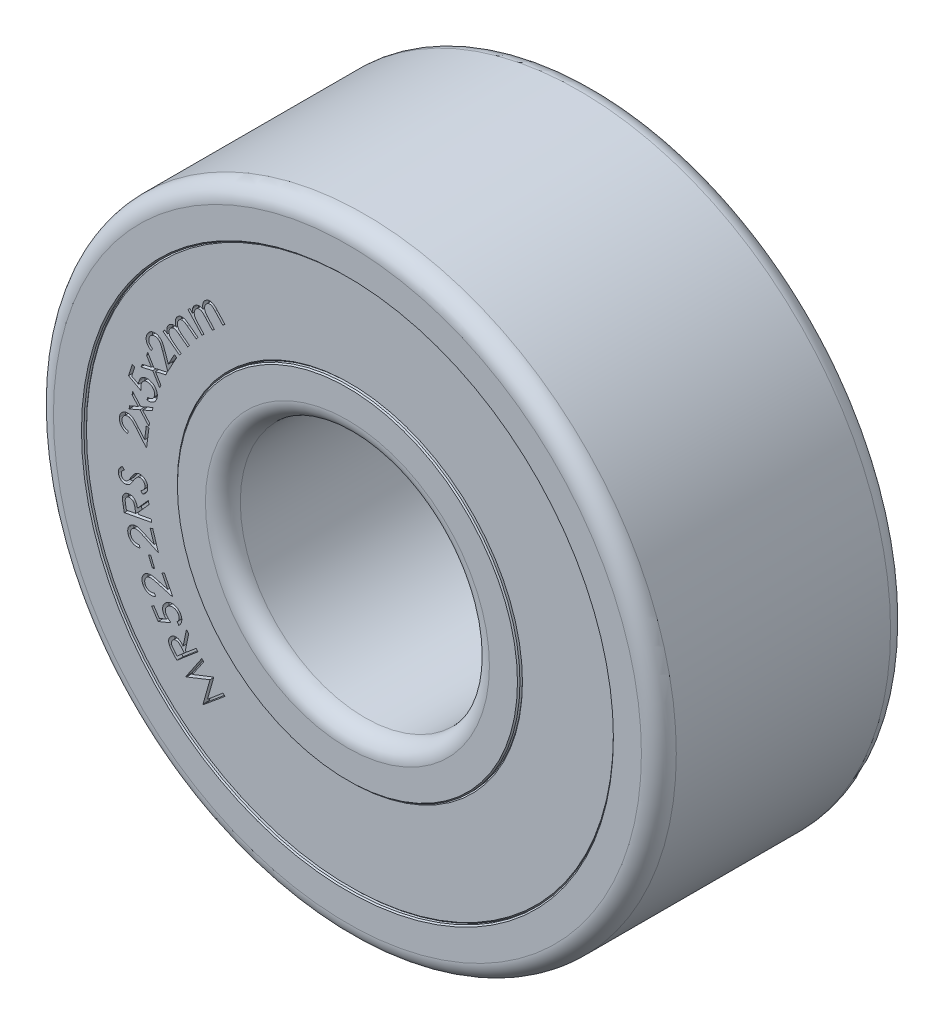
from build123d import *

# Parameters (mm, degrees)
SKETCH_R_INNER_BODY_W          = 2
SKETCH_R_INNER_BODY_H          = 0.375
FILLET_INNER_BODY_R            = 0.14
CHAMFER_INNER_BODY_SIZE        = 0.01
SKETCH_R_OUTER_BODY_W          = 2
SKETCH_R_OUTER_BODY_H          = 0.375
FILLET_OUTER_BODY_R            = 0.14
CHAMFER_OUTER_BODY_SIZE        = 0.01
SKETCH_R_SEAL_FACES_W          = 1.96
SKETCH_R_SEAL_FACES_H          = 0.75
CHAMFER_SEALS_SIZE             = 0.01
CUT_EXTRUDE_SEAL_LABEL_1_DEPTH = 0.05
CUT_EXTRUDE_SEAL_LABEL_2_DEPTH = 0.05


with BuildPart() as part:
    # Sketch R, INNER BODY → Revolve INNER BODY (revolve)
    with BuildSketch(Plane(origin=(0, 0, 0), x_dir=(0, 0, -1), z_dir=(1, 0, 0)), mode=Mode.PRIVATE) as revolve_inner_body_sk:
        with Locations((0, 1.1875)):
            Rectangle(SKETCH_R_INNER_BODY_W, SKETCH_R_INNER_BODY_H)
    revolve(revolve_inner_body_sk.sketch.rotate(Axis((0, 0, 17.5), (0, 0, -1)), 90), axis=Axis((0, 0, 17.5), (0, 0, -1)))

    # Fillet INNER BODY
    fillet_inner_body_edges = [part.edges().sort_by_distance(p)[0] for p in [
        (-1, 0, -1),
        (-1, 0, 1),
    ]]
    fillet(fillet_inner_body_edges, radius=FILLET_INNER_BODY_R)

    # Chamfer INNER BODY
    chamfer_inner_body_edges = [part.edges().sort_by_distance(p)[0] for p in [
        (-1.375, 0, 1),
        (-1.375, 0, -1),
    ]]
    chamfer(chamfer_inner_body_edges, length=CHAMFER_INNER_BODY_SIZE)


with BuildPart() as body_2:
    # Sketch R, OUTER BODY → Revolve OUTER BODY (revolve)
    with BuildSketch(Plane(origin=(0, 0, 0), x_dir=(0, 0, -1), z_dir=(1, 0, 0)), mode=Mode.PRIVATE) as revolve_outer_body_sk:
        with Locations((0, 2.3125)):
            Rectangle(SKETCH_R_OUTER_BODY_W, SKETCH_R_OUTER_BODY_H)
    revolve(revolve_outer_body_sk.sketch.rotate(Axis((0, 0, 17.5), (0, 0, -1)), 90), axis=Axis((0, 0, 17.5), (0, 0, -1)))

    # Fillet OUTER BODY
    fillet_outer_body_edges = [body_2.edges().sort_by_distance(p)[0] for p in [
        (-2.5, 0, 1),
        (-2.5, 0, -1),
    ]]
    fillet(fillet_outer_body_edges, radius=FILLET_OUTER_BODY_R)

    # Chamfer OUTER BODY
    chamfer_outer_body_edges = [body_2.edges().sort_by_distance(p)[0] for p in [
        (-2.125, 0, -1),
        (-2.125, 0, 1),
    ]]
    chamfer(chamfer_outer_body_edges, length=CHAMFER_OUTER_BODY_SIZE)


with BuildPart() as body_3:
    # Sketch R, SEAL FACES → Revolve SEALS (revolve)
    with BuildSketch(Plane(origin=(0, 0, 0), x_dir=(0, 0, -1), z_dir=(1, 0, 0)), mode=Mode.PRIVATE) as revolve_seals_sk:
        with Locations((0, 1.75)):
            Rectangle(SKETCH_R_SEAL_FACES_W, SKETCH_R_SEAL_FACES_H)
    revolve(revolve_seals_sk.sketch.rotate(Axis((0, 0, 17.5), (0, 0, -1)), 270), axis=Axis((0, 0, 17.5), (0, 0, -1)))

    # Chamfer SEALS
    chamfer_seals_edges = [body_3.edges().sort_by_distance(p)[0] for p in [
        (1.375, 0, -0.98),
        (1.375, 0, 0.98),
        (2.125, 0, 0.98),
        (2.125, 0, -0.98),
    ]]
    chamfer(chamfer_seals_edges, length=CHAMFER_SEALS_SIZE)

    # Sketch TEXT RADIUS 1 — MANUALLY ASSIGN TEXT AND FONT SIZE (FROM EQUATIONS) → Cut-Extrude SEAL LABEL 1 (cut)
    # profile 1 of 15: a face of its own
    with BuildSketch(Plane.XY.offset(0.98)):
        with BuildLine():
            Line((-1.299880304, 1.247412684), (-1.28424028, 1.261745616))
            Line((-1.28424028, 1.261745616), (-1.264814198, 1.240561722))
            add(Edge.make_bspline(
                [(-1.264814198, 1.240561722), (-1.2651524, 1.243638017), (-1.265801096, 1.24953856), (-1.265896916, 1.25809289), (-1.265249316, 1.26593243), (-1.264131728, 1.270814195), (-1.263597251, 1.273148862)],
                knots=[0, 0, 0, 0, 1.131394257, 2.170091243, 3.124860317, 4, 4, 4, 4], degree=3))
            add(Edge.make_bspline(
                [(-1.263597251, 1.273148862), (-1.262625812, 1.276081506), (-1.260710474, 1.281863655), (-1.256485358, 1.289861795), (-1.251385106, 1.29719541), (-1.247184914, 1.301348639), (-1.245072611, 1.303437323)],
                knots=[0, 0, 0, 0, 1.030125518, 2.031046627, 3.009801277, 4, 4, 4, 4], degree=3))
            add(Edge.make_bspline(
                [(-1.245072611, 1.303437323), (-1.243566843, 1.304734134), (-1.240581932, 1.307304825), (-1.235653796, 1.310531833), (-1.230511179, 1.313338992), (-1.225068093, 1.315444343), (-1.219572311, 1.317086149), (-1.214086112, 1.318089674), (-1.208702157, 1.31846296), (-1.203329457, 1.318184614), (-1.197797771, 1.317215227), (-1.191972331, 1.315391897), (-1.185729662, 1.312859702), (-1.181549184, 1.310699611), (-1.179357467, 1.309567131)],
                knots=[0, 0, 0, 0, 1.005081769, 1.99239158, 2.975855534, 3.966003415, 4.940840325, 5.876304085, 6.783509039, 7.667031189, 8.593670794, 9.618758704, 10.751576457, 12, 12, 12, 12], degree=3))
            add(Edge.make_bspline(
                [(-1.179357467, 1.309567131), (-1.179767694, 1.311350949), (-1.180573796, 1.314856176), (-1.181432549, 1.320124132), (-1.181967853, 1.325285683), (-1.182221936, 1.330344056), (-1.182051782, 1.335280167), (-1.181683676, 1.340119098), (-1.180896109, 1.344860128), (-1.179474683, 1.35098461), (-1.176970374, 1.358322041), (-1.172804271, 1.36646298), (-1.167577845, 1.373921349), (-1.163304447, 1.378181115), (-1.161148333, 1.380330352)],
                knots=[0, 0, 0, 0, 0.857318453, 1.684643176, 2.498444861, 3.287522046, 4.054989648, 4.81074943, 5.55939664, 6.303763651, 7.754989842, 9.17777577, 10.576065555, 12, 12, 12, 12], degree=3))
            add(Edge.make_bspline(
                [(-1.161148333, 1.380330352), (-1.159022071, 1.382159169), (-1.154854451, 1.385743775), (-1.147812401, 1.389828037), (-1.140488548, 1.392889657), (-1.132825864, 1.394654851), (-1.125020226, 1.395385818), (-1.117174762, 1.394752034), (-1.10938235, 1.39297671), (-1.10298197, 1.390471987), (-1.097812248, 1.387797546), (-1.093714764, 1.385266113), (-1.089468611, 1.38220286), (-1.085009524, 1.37869301), (-1.080373442, 1.37466577), (-1.075552747, 1.370165387), (-1.070591562, 1.365130088), (-1.067269689, 1.361573297), (-1.065550376, 1.359732395)],
                knots=[0, 0, 0, 0, 1.207137441, 2.366072289, 3.49342759, 4.618621206, 5.743684242, 6.861241471, 7.997590316, 9.179105743, 9.813711851, 10.50598963, 11.253880101, 12.070458713, 12.952404928, 13.901277549, 14.913756755, 16, 16, 16, 16], degree=3))
            Line((-1.065550376, 1.359732395), (-1.004207227, 1.292800304))
            Line((-1.004207227, 1.292800304), (-1.020297972, 1.27801665))
            Line((-1.020297972, 1.27801665), (-1.081641121, 1.344948741))
            add(Edge.make_bspline(
                [(-1.081641121, 1.344948741), (-1.083088991, 1.3465203), (-1.085875946, 1.349545339), (-1.090030635, 1.353746318), (-1.093837742, 1.357575757), (-1.097459555, 1.360852218), (-1.100771014, 1.363710747), (-1.10384806, 1.366063647), (-1.106637511, 1.367975803), (-1.109970893, 1.369907035), (-1.114128163, 1.37155061), (-1.119205379, 1.372840789), (-1.124496193, 1.373093356), (-1.129876559, 1.372677247), (-1.135274455, 1.371343274), (-1.140547156, 1.369170186), (-1.14559642, 1.366054527), (-1.148665552, 1.363455334), (-1.150240881, 1.362121217)],
                knots=[0, 0, 0, 0, 1.259477372, 2.424325097, 3.482665592, 4.441793653, 5.302484303, 6.06060584, 6.723814375, 7.295020387, 8.327818791, 9.348125287, 10.368470216, 11.434894695, 12.51962228, 13.631415985, 14.784250289, 16, 16, 16, 16], degree=3))
            add(Edge.make_bspline(
                [(-1.150240881, 1.362121217), (-1.152044075, 1.360310621), (-1.155611676, 1.356728375), (-1.159897263, 1.350434864), (-1.163114458, 1.343518329), (-1.165245778, 1.33609448), (-1.166351909, 1.328400675), (-1.166244909, 1.320621469), (-1.165011839, 1.312861971), (-1.162992977, 1.306425018), (-1.16068269, 1.301125284), (-1.158293906, 1.296791687), (-1.155360048, 1.292122562), (-1.151852232, 1.287098203), (-1.147810167, 1.281715078), (-1.143186905, 1.275980309), (-1.138015717, 1.269895546), (-1.134283442, 1.265805506), (-1.132347251, 1.263683717)],
                knots=[0, 0, 0, 0, 1.080267809, 2.1372993, 3.204619372, 4.297866689, 5.396432358, 6.484409731, 7.579506625, 8.712390312, 9.330586109, 10.025181949, 10.805429485, 11.66488912, 12.619189967, 13.655494097, 14.783741584, 16, 16, 16, 16], degree=3))
            Line((-1.132347251, 1.263683717), (-1.088356866, 1.215681915))
            Line((-1.088356866, 1.215681915), (-1.104041962, 1.20130391))
            Line((-1.104041962, 1.20130391), (-1.161599054, 1.264089366))
            add(Edge.make_bspline(
                [(-1.161599054, 1.264089366), (-1.163231491, 1.265851993), (-1.166365686, 1.269236144), (-1.170946489, 1.27401704), (-1.175226505, 1.278242604), (-1.179156702, 1.28198006), (-1.182790266, 1.28515471), (-1.186077115, 1.287866038), (-1.189096919, 1.289971244), (-1.192608678, 1.292150964), (-1.196934005, 1.294101501), (-1.202267016, 1.29551165), (-1.207743703, 1.296052714), (-1.213298705, 1.295743), (-1.218804914, 1.294513957), (-1.224166865, 1.292407633), (-1.229293763, 1.289371956), (-1.232368582, 1.286748863), (-1.233939799, 1.285408477)],
                knots=[0, 0, 0, 0, 1.331949286, 2.557273324, 3.670478484, 4.66630577, 5.563504719, 6.345331026, 7.027033542, 7.602738468, 8.635402996, 9.643590099, 10.648123214, 11.674317518, 12.715113256, 13.762289003, 14.856541529, 16, 16, 16, 16], degree=3))
            add(Edge.make_bspline(
                [(-1.233939799, 1.285408477), (-1.235665798, 1.28367083), (-1.239101031, 1.280212416), (-1.243229135, 1.274107461), (-1.24640465, 1.267368956), (-1.248585259, 1.260076823), (-1.249782609, 1.252475786), (-1.249745776, 1.244730407), (-1.248676808, 1.236984868), (-1.246776723, 1.230539628), (-1.244568315, 1.22532185), (-1.242437569, 1.221116202), (-1.239804643, 1.216698979), (-1.236672149, 1.212048302), (-1.233049734, 1.207154256), (-1.229019254, 1.201963395), (-1.224428983, 1.196609167), (-1.22119116, 1.192989513), (-1.219516722, 1.191117612)],
                knots=[0, 0, 0, 0, 1.089555513, 2.168526947, 3.264686509, 4.397865164, 5.549311469, 6.68082741, 7.836955477, 9.023376397, 9.66252914, 10.36019728, 11.122645707, 11.95270842, 12.857969703, 13.835698692, 14.880732742, 16, 16, 16, 16], degree=3))
            Line((-1.219516722, 1.191117612), (-1.171875496, 1.139149463))
            Line((-1.171875496, 1.139149463), (-1.18751552, 1.12481653))
            Line((-1.18751552, 1.12481653), (-1.299880304, 1.247412684))
        make_face()
    # profile 2 of 15: a face of its own
    with BuildSketch(Plane.XY.offset(0.98)):
        with BuildLine():
            Line((-1.499867229, 0.995489883), (-1.487292108, 1.012301782))
            Line((-1.487292108, 1.012301782), (-1.46453069, 0.995309594))
            add(Edge.make_bspline(
                [(-1.46453069, 0.995309594), (-1.465421271, 0.998241603), (-1.467127549, 1.003859083), (-1.468803851, 1.012149731), (-1.469675444, 1.019887892), (-1.469457713, 1.024845606), (-1.469353407, 1.027220652)],
                knots=[0, 0, 0, 0, 1.131805281, 2.168442941, 3.12257277, 4, 4, 4, 4], degree=3))
            add(Edge.make_bspline(
                [(-1.469353407, 1.027220652), (-1.46894143, 1.030257627), (-1.468132119, 1.03622363), (-1.465488876, 1.044789807), (-1.461808436, 1.052817755), (-1.458516703, 1.057655711), (-1.456868431, 1.060078224)],
                knots=[0, 0, 0, 0, 1.032601372, 2.028500267, 3.012809719, 4, 4, 4, 4], degree=3))
            add(Edge.make_bspline(
                [(-1.456868431, 1.060078224), (-1.455639305, 1.061624964), (-1.453205986, 1.064687069), (-1.448997246, 1.068742662), (-1.444487725, 1.072400802), (-1.439575256, 1.075446293), (-1.434543795, 1.078097654), (-1.429377893, 1.080003808), (-1.424245219, 1.081423693), (-1.418968769, 1.082096292), (-1.41341703, 1.082130741), (-1.407405141, 1.081462887), (-1.400885639, 1.080084194), (-1.396417826, 1.078756069), (-1.394082974, 1.078061998)],
                knots=[0, 0, 0, 0, 1.009349943, 1.998225686, 2.982193828, 3.973395149, 4.949320681, 5.885478813, 6.783791399, 7.667260299, 8.596995586, 9.616906092, 10.75460912, 12, 12, 12, 12], degree=3))
            add(Edge.make_bspline(
                [(-1.394082974, 1.078061998), (-1.395469927, 1.081353456), (-1.398168559, 1.087757733), (-1.400793029, 1.097619288), (-1.402108622, 1.107316463), (-1.402004915, 1.116813505), (-1.400667326, 1.125975118), (-1.398109325, 1.134675244), (-1.394439597, 1.142903544), (-1.391052259, 1.147834966), (-1.389350402, 1.150312599)],
                knots=[0, 0, 0, 0, 1.125143237, 2.18922074, 3.206944074, 4.201819615, 5.173933683, 6.116844367, 7.053869823, 8, 8, 8, 8], degree=3))
            add(Edge.make_bspline(
                [(-1.389350402, 1.150312599), (-1.387605456, 1.152468738), (-1.38419129, 1.156687443), (-1.378163828, 1.162024973), (-1.371543685, 1.166248098), (-1.364464156, 1.169472199), (-1.356983942, 1.171554083), (-1.349259003, 1.172476101), (-1.341358398, 1.172120625), (-1.334686641, 1.170870475), (-1.329179804, 1.169219479), (-1.324736349, 1.167465029), (-1.320011997, 1.165299405), (-1.315015187, 1.162685123), (-1.309792953, 1.159589398), (-1.304262396, 1.156109175), (-1.29847155, 1.152158659), (-1.294583871, 1.149274667), (-1.29258057, 1.147788561)],
                knots=[0, 0, 0, 0, 1.206733197, 2.361097122, 3.488449923, 4.616106612, 5.73711602, 6.857341927, 7.990454685, 9.168779193, 9.804397971, 10.492279479, 11.247842311, 12.067465172, 12.947441551, 13.891587522, 14.913545837, 16, 16, 16, 16], degree=3))
            Line((-1.29258057, 1.147788561), (-1.220645474, 1.093972455))
            Line((-1.220645474, 1.093972455), (-1.233626243, 1.076664763))
            Line((-1.233626243, 1.076664763), (-1.305561339, 1.130480868))
            add(Edge.make_bspline(
                [(-1.305561339, 1.130480868), (-1.307266382, 1.13175362), (-1.310528003, 1.134188299), (-1.315343897, 1.137522834), (-1.319763057, 1.140514758), (-1.323896473, 1.143020246), (-1.327610704, 1.14523724), (-1.331057345, 1.146918525), (-1.334106679, 1.148334769), (-1.337744474, 1.149500764), (-1.342078383, 1.150401006), (-1.347270668, 1.15064175), (-1.352470701, 1.149978547), (-1.35761991, 1.148525874), (-1.362631538, 1.14629114), (-1.367300453, 1.143165398), (-1.371674363, 1.139291047), (-1.374146165, 1.136186346), (-1.375423118, 1.134582431)],
                knots=[0, 0, 0, 0, 1.267410453, 2.424461847, 3.489399181, 4.445743841, 5.303901467, 6.064415156, 6.729635115, 7.304200878, 8.336324222, 9.357641329, 10.385642851, 11.445414857, 12.535040186, 13.639706619, 14.780652696, 16, 16, 16, 16], degree=3))
            add(Edge.make_bspline(
                [(-1.375423118, 1.134582431), (-1.376869454, 1.132493887), (-1.379725589, 1.128369559), (-1.382620078, 1.12139762), (-1.384576475, 1.11410935), (-1.385229402, 1.106483843), (-1.384926076, 1.098795141), (-1.383334679, 1.091260814), (-1.380747909, 1.083928128), (-1.377596556, 1.078047848), (-1.374374768, 1.073320045), (-1.371277037, 1.069543064), (-1.367569196, 1.065530871), (-1.363211598, 1.06131853), (-1.358321543, 1.056793527), (-1.352731343, 1.052123729), (-1.346579097, 1.047168285), (-1.342213732, 1.043856084), (-1.339951363, 1.042139522)],
                knots=[0, 0, 0, 0, 1.084071984, 2.14075819, 3.210249884, 4.301387518, 5.401725274, 6.490873214, 7.582616511, 8.718428309, 9.333508526, 10.028175374, 10.80603251, 11.669642812, 12.620441853, 13.65577946, 14.785097934, 16, 16, 16, 16], degree=3))
            Line((-1.339951363, 1.042139522), (-1.288343791, 1.003512719))
            Line((-1.288343791, 1.003512719), (-1.300963983, 0.986655748))
            Line((-1.300963983, 0.986655748), (-1.36843694, 1.037136517))
            add(Edge.make_bspline(
                [(-1.36843694, 1.037136517), (-1.370356603, 1.038553373), (-1.374027142, 1.041262505), (-1.379354023, 1.04508203), (-1.384300534, 1.048392874), (-1.388817376, 1.051313482), (-1.392933509, 1.0537427), (-1.396668282, 1.055704653), (-1.399970364, 1.0572447), (-1.403793743, 1.058702315), (-1.408353264, 1.059755558), (-1.413779787, 1.060177328), (-1.419218865, 1.0597265), (-1.424561424, 1.058349738), (-1.429744277, 1.056201482), (-1.434548788, 1.053127492), (-1.438993089, 1.049266723), (-1.441484521, 1.046163281), (-1.442760858, 1.044573417)],
                knots=[0, 0, 0, 0, 1.336429632, 2.555352704, 3.67101711, 4.670145963, 5.567873788, 6.347057683, 7.032381483, 7.607589556, 8.636367193, 9.64065698, 10.645616446, 11.678378945, 12.719303542, 13.774586397, 14.859941629, 16, 16, 16, 16], degree=3))
            add(Edge.make_bspline(
                [(-1.442760858, 1.044573417), (-1.444123434, 1.042570239), (-1.446832517, 1.038587505), (-1.449655412, 1.031868124), (-1.451526441, 1.024737273), (-1.45230988, 1.017233737), (-1.452067357, 1.00960894), (-1.450631589, 1.002081779), (-1.448136065, 0.994757353), (-1.445093506, 0.988860486), (-1.442021301, 0.984176566), (-1.439132253, 0.980506988), (-1.435755703, 0.976690431), (-1.431848863, 0.972732016), (-1.427499077, 0.968567547), (-1.422542858, 0.964360725), (-1.417154954, 0.959929619), (-1.413323835, 0.957015601), (-1.411345594, 0.955510917)],
                knots=[0, 0, 0, 0, 1.088531447, 2.164227711, 3.261927576, 4.398200911, 5.548941493, 6.684670989, 7.835610395, 9.021602655, 9.661408722, 10.355589153, 11.122437957, 11.954816964, 12.859209374, 13.832901402, 14.880994811, 16, 16, 16, 16], degree=3))
            Line((-1.411345594, 0.955510917), (-1.355501243, 0.913729066))
            Line((-1.355501243, 0.913729066), (-1.368076363, 0.896917167))
            Line((-1.368076363, 0.896917167), (-1.499867229, 0.995489883))
        make_face()
    # profile 3 of 15: a face of its own
    with BuildSketch(Plane.XY.offset(0.98)):
        with BuildLine():
            Line((-1.585015452, 0.83243471), (-1.595246823, 0.813549494))
            add(Edge.make_bspline(
                [(-1.595246823, 0.813549494), (-1.597573967, 0.814964582), (-1.602128657, 0.817734196), (-1.608365361, 0.822536235), (-1.614049794, 0.827602526), (-1.619033156, 0.833158976), (-1.62340183, 0.839063201), (-1.627200654, 0.845315885), (-1.630253881, 0.852003927), (-1.632718866, 0.858986415), (-1.634523355, 0.866137002), (-1.635562407, 0.873326006), (-1.63590607, 0.880456001), (-1.635412481, 0.88754889), (-1.634315931, 0.894611264), (-1.632385196, 0.90160669), (-1.629775237, 0.908580603), (-1.627474958, 0.91304493), (-1.62630151, 0.91532233)],
                knots=[0, 0, 0, 0, 1.101924003, 2.156687473, 3.181652098, 4.180843647, 5.172340557, 6.151880089, 7.137069119, 8.14321643, 9.146399144, 10.117593301, 11.079600848, 12.03044786, 12.99145492, 13.968271087, 14.963548405, 16, 16, 16, 16], degree=3))
            add(Edge.make_bspline(
                [(-1.62630151, 0.91532233), (-1.625051567, 0.917512506), (-1.622612125, 0.921786944), (-1.618313071, 0.927629129), (-1.613708357, 0.932903304), (-1.608711603, 0.937566617), (-1.603291183, 0.941551464), (-1.597549142, 0.94495726), (-1.591415087, 0.947735263), (-1.58495693, 0.949792689), (-1.578389566, 0.951350469), (-1.571818542, 0.952179517), (-1.565345165, 0.952499842), (-1.558962949, 0.952051081), (-1.552653975, 0.951097329), (-1.546471012, 0.949372864), (-1.540324436, 0.947160242), (-1.536422642, 0.945145056), (-1.534444539, 0.944123412)],
                knots=[0, 0, 0, 0, 1.125434309, 2.196445452, 3.232911465, 4.248977359, 5.242073912, 6.231741639, 7.225767157, 8.242165333, 9.254568916, 10.235830117, 11.196198448, 12.144227991, 13.088522077, 14.04072172, 15.006699453, 16, 16, 16, 16], degree=3))
            add(Edge.make_bspline(
                [(-1.534444539, 0.944123412), (-1.531738804, 0.94252445), (-1.526391478, 0.939364429), (-1.519202648, 0.933429424), (-1.512806206, 0.926684701), (-1.508146441, 0.920282699), (-1.504697634, 0.914548886), (-1.502042378, 0.909558981), (-1.499311785, 0.903927386), (-1.496471512, 0.897666513), (-1.493582931, 0.89075348), (-1.490683297, 0.883177125), (-1.487637189, 0.874972439), (-1.485692319, 0.869248653), (-1.484684924, 0.866283869)],
                knots=[0, 0, 0, 0, 1.192008222, 2.355758747, 3.526161442, 4.714107456, 5.354030055, 6.066201884, 6.859767274, 7.730473944, 8.676695749, 9.704446459, 10.810958423, 12, 12, 12, 12], degree=3))
            Line((-1.484684924, 0.866283869), (-1.458452952, 0.788624614))
            Line((-1.458452952, 0.788624614), (-1.409098986, 0.879489999))
            Line((-1.409098986, 0.879489999), (-1.390078553, 0.869168484))
            Line((-1.390078553, 0.869168484), (-1.462689731, 0.73548459))
            Line((-1.462689731, 0.73548459), (-1.503074347, 0.854790479))
            add(Edge.make_bspline(
                [(-1.503074347, 0.854790479), (-1.504038034, 0.857694548), (-1.505886309, 0.863264318), (-1.508752206, 0.871213811), (-1.511454835, 0.878471387), (-1.513985572, 0.885045047), (-1.516476179, 0.890866314), (-1.518819638, 0.895977125), (-1.521008859, 0.900392749), (-1.523724658, 0.905299899), (-1.527441909, 0.910593375), (-1.532434191, 0.916167848), (-1.538103261, 0.920968003), (-1.542323256, 0.923477413), (-1.544450549, 0.924742403)],
                knots=[0, 0, 0, 0, 1.321780634, 2.535068755, 3.65022817, 4.667483109, 5.577667619, 6.385011738, 7.096147476, 7.706383098, 8.80650101, 9.881833079, 10.932235596, 12, 12, 12, 12], degree=3))
            add(Edge.make_bspline(
                [(-1.544450549, 0.924742403), (-1.545833658, 0.925450105), (-1.548554962, 0.926842529), (-1.552844913, 0.928366788), (-1.55717682, 0.929457837), (-1.561572034, 0.930088017), (-1.566029164, 0.930285298), (-1.570557533, 0.929940452), (-1.57516648, 0.929186641), (-1.57976166, 0.927917232), (-1.58425477, 0.926256838), (-1.588534353, 0.924240902), (-1.592542307, 0.92185181), (-1.596202926, 0.919006846), (-1.599657972, 0.915854448), (-1.602805041, 0.912282713), (-1.605669285, 0.908339927), (-1.607306292, 0.90549749), (-1.608137448, 0.904054302)],
                knots=[0, 0, 0, 0, 1.000471395, 1.968453413, 2.926698893, 3.875750352, 4.825542583, 5.796281632, 6.797643064, 7.831261211, 8.863790097, 9.88173018, 10.876514763, 11.864299062, 12.864864183, 13.88698719, 14.927162029, 16, 16, 16, 16], degree=3))
            add(Edge.make_bspline(
                [(-1.608137448, 0.904054302), (-1.608928265, 0.90248842), (-1.610482738, 0.899410442), (-1.612360142, 0.894658691), (-1.613652351, 0.889876922), (-1.614491569, 0.885078999), (-1.614795033, 0.880275107), (-1.614633965, 0.875437007), (-1.61387021, 0.870615764), (-1.612735095, 0.865782248), (-1.610996155, 0.861048566), (-1.608791305, 0.85643632), (-1.606051972, 0.851996335), (-1.602848001, 0.847704593), (-1.599127161, 0.843596035), (-1.594912725, 0.839653324), (-1.590164258, 0.835926739), (-1.586757613, 0.83361628), (-1.585015452, 0.83243471)],
                knots=[0, 0, 0, 0, 1.004351244, 1.974204114, 2.919746415, 3.836347205, 4.75894536, 5.671620648, 6.602486585, 7.54990605, 8.510671201, 9.48429509, 10.472971535, 11.493409801, 12.547358397, 13.64307963, 14.794669178, 16, 16, 16, 16], degree=3))
        make_face()
    # profile 4 of 15: a face of its own
    with BuildSketch(Plane.XY.offset(0.98)):
        Polygon((-1.677209977, 0.660026448), (-1.667113824, 0.683463948), (-1.593601203, 0.699419476), (-1.632543511, 0.763782457), (-1.622447357, 0.787219957), (-1.572687742, 0.704287265), (-1.467895074, 0.728400847), (-1.478126444, 0.704692914), (-1.561825362, 0.685717553), (-1.517834977, 0.612520438), (-1.527840987, 0.589218154), (-1.582738824, 0.680984981), align=None)
    # profile 5 of 15: a face of its own
    with BuildSketch(Plane.XY.offset(0.98)):
        with BuildLine():
            Line((-1.747083316, 0.641403831), (-1.726755792, 0.63477823))
            Line((-1.726755792, 0.63477823), (-1.751455311, 0.558786644))
            Line((-1.751455311, 0.558786644), (-1.696692691, 0.52930948))
            add(Edge.make_bspline(
                [(-1.696692691, 0.52930948), (-1.696589365, 0.531760772), (-1.696388532, 0.536525314), (-1.695573603, 0.54339181), (-1.694390785, 0.549776249), (-1.693210159, 0.553776855), (-1.6926362, 0.55572174)],
                knots=[0, 0, 0, 0, 1.097881072, 2.133936549, 3.092817518, 4, 4, 4, 4], degree=3))
            add(Edge.make_bspline(
                [(-1.6926362, 0.55572174), (-1.691806826, 0.558082064), (-1.690177243, 0.562719706), (-1.687053246, 0.569282435), (-1.683392006, 0.575304288), (-1.679216337, 0.580797085), (-1.674549748, 0.585781421), (-1.669393991, 0.590265269), (-1.663717795, 0.594219573), (-1.657561934, 0.597555531), (-1.651097556, 0.600355716), (-1.644425213, 0.602478255), (-1.637584342, 0.603904115), (-1.630602618, 0.604552207), (-1.623462491, 0.604565266), (-1.616189218, 0.603821794), (-1.608766887, 0.602381768), (-1.603863099, 0.600911688), (-1.601365167, 0.600162846)],
                knots=[0, 0, 0, 0, 1.054527707, 2.071970733, 3.058645409, 4.021744774, 4.976555119, 5.933213675, 6.898166177, 7.887766025, 8.881131472, 9.865015099, 10.835505781, 11.822180457, 12.816939195, 13.84206708, 14.900774159, 16, 16, 16, 16], degree=3))
            add(Edge.make_bspline(
                [(-1.601365167, 0.600162846), (-1.599644704, 0.599567428), (-1.596225485, 0.598384104), (-1.591272139, 0.596259952), (-1.586520699, 0.593857626), (-1.581963921, 0.591209523), (-1.577643066, 0.588267259), (-1.573499791, 0.585099465), (-1.569588285, 0.581630593), (-1.565912505, 0.577899881), (-1.562490932, 0.573990367), (-1.559369227, 0.56992839), (-1.556586228, 0.565732495), (-1.554063612, 0.561438961), (-1.551961212, 0.556959888), (-1.550163525, 0.552365075), (-1.548642665, 0.547648056), (-1.547543006, 0.542786177), (-1.546731902, 0.537833985), (-1.546221532, 0.532806739), (-1.546093749, 0.527715353), (-1.546315918, 0.522564184), (-1.546925161, 0.51735984), (-1.547817978, 0.512073493), (-1.54908121, 0.506717742), (-1.550159146, 0.503162276), (-1.550704109, 0.501364769)],
                knots=[0, 0, 0, 0, 1.053320847, 2.093352781, 3.115976633, 4.132966969, 5.140960681, 6.139157571, 7.14928635, 8.163709041, 9.168096593, 10.154102239, 11.1258989, 12.080310164, 13.033136025, 13.985723849, 14.934375425, 15.898205125, 16.867314409, 17.837125465, 18.819944309, 19.812064303, 20.818294114, 21.850299864, 22.913193954, 24, 24, 24, 24], degree=3))
            add(Edge.make_bspline(
                [(-1.550704109, 0.501364769), (-1.551433852, 0.499262159), (-1.552875819, 0.495107421), (-1.555638288, 0.489214529), (-1.558800454, 0.483748213), (-1.56233886, 0.478663895), (-1.566365173, 0.474052334), (-1.570736572, 0.469776934), (-1.575562708, 0.465968157), (-1.580760539, 0.462614992), (-1.586240292, 0.459741751), (-1.59189514, 0.457384168), (-1.59770202, 0.455564883), (-1.603663923, 0.454306625), (-1.60977381, 0.453582828), (-1.616016713, 0.453413676), (-1.62241304, 0.453759303), (-1.626684972, 0.454422612), (-1.628859157, 0.454760202)],
                knots=[0, 0, 0, 0, 1.068838916, 2.112016429, 3.121142818, 4.100497676, 5.083172616, 6.058261274, 7.034605062, 8.031783173, 9.026318639, 10.003649374, 10.971738446, 11.945837886, 12.927212692, 13.923841919, 14.943346523, 16, 16, 16, 16], degree=3))
            Line((-1.628859157, 0.454760202), (-1.621737763, 0.47666525))
            add(Edge.make_bspline(
                [(-1.621737763, 0.47666525), (-1.619621451, 0.476474185), (-1.615543332, 0.476106005), (-1.609602322, 0.476231449), (-1.604103385, 0.476976151), (-1.599006169, 0.478386731), (-1.594261027, 0.480473945), (-1.589736526, 0.483079551), (-1.58545897, 0.486341572), (-1.581448306, 0.490127649), (-1.57781784, 0.494398144), (-1.574651874, 0.498989785), (-1.572020348, 0.503912848), (-1.570764156, 0.507401579), (-1.570130191, 0.509162245)],
                knots=[0, 0, 0, 0, 1.149660998, 2.2153889, 3.209170822, 4.146501705, 5.068140212, 6.008360075, 6.966455977, 7.973298224, 8.988678036, 9.994830203, 10.988046181, 12, 12, 12, 12], degree=3))
            add(Edge.make_bspline(
                [(-1.570130191, 0.509162245), (-1.569608887, 0.510895236), (-1.568578353, 0.514321077), (-1.567751745, 0.519591531), (-1.56742652, 0.524828952), (-1.567640852, 0.530045271), (-1.568467239, 0.535229533), (-1.569878474, 0.540374915), (-1.57184552, 0.545496239), (-1.574287343, 0.550553127), (-1.577266305, 0.555371019), (-1.580566532, 0.559935858), (-1.584432107, 0.56397362), (-1.58854705, 0.567779239), (-1.593200643, 0.571033406), (-1.598178548, 0.5740066), (-1.603591873, 0.576527349), (-1.607407303, 0.577854796), (-1.609342931, 0.57852823)],
                knots=[0, 0, 0, 0, 0.97767053, 1.93269637, 2.876877981, 3.812103142, 4.749795456, 5.709647475, 6.691965746, 7.713032911, 8.74137947, 9.752115167, 10.752346699, 11.759057826, 12.778151286, 13.816240882, 14.892144857, 16, 16, 16, 16], degree=3))
            add(Edge.make_bspline(
                [(-1.609342931, 0.57852823), (-1.611122789, 0.579055504), (-1.614604342, 0.580086897), (-1.619857283, 0.581071849), (-1.62498537, 0.58158257), (-1.630015098, 0.5815955), (-1.634946716, 0.581062293), (-1.639736963, 0.579948166), (-1.644434415, 0.578425156), (-1.648954663, 0.576342623), (-1.653270927, 0.573841719), (-1.657281888, 0.570884206), (-1.66093465, 0.56748007), (-1.664287685, 0.563687437), (-1.667281474, 0.559449266), (-1.669925839, 0.55478963), (-1.672301013, 0.549716821), (-1.673557319, 0.546118884), (-1.674201705, 0.544273423)],
                knots=[0, 0, 0, 0, 1.077922765, 2.108508458, 3.099521068, 4.068413807, 5.025597441, 5.974265856, 6.921045012, 7.889780462, 8.859891316, 9.814843565, 10.778413651, 11.755567429, 12.750990954, 13.787106568, 14.864958648, 16, 16, 16, 16], degree=3))
            add(Edge.make_bspline(
                [(-1.674201705, 0.544273423), (-1.674688578, 0.542641517), (-1.675685271, 0.539300793), (-1.676814318, 0.534030489), (-1.677582302, 0.528392434), (-1.678197411, 0.522396116), (-1.678437562, 0.516015432), (-1.678434585, 0.509280133), (-1.678165002, 0.502168265), (-1.677780105, 0.497322155), (-1.677582114, 0.494829312)],
                knots=[0, 0, 0, 0, 0.819259977, 1.677131309, 2.590134162, 3.556233569, 4.576508856, 5.660926725, 6.796779312, 8, 8, 8, 8], degree=3))
            Line((-1.677582114, 0.494829312), (-1.777101344, 0.549005995))
            Line((-1.777101344, 0.549005995), (-1.747083316, 0.641403831))
        make_face()
    # profile 6 of 15: a face of its own
    with BuildSketch(Plane.XY.offset(0.98)):
        Polygon((-1.773340709, 0.319931175), (-1.767841911, 0.344765911), (-1.69879143, 0.37415293), (-1.748911622, 0.429952209), (-1.743412824, 0.454832016), (-1.67918506, 0.382851848), (-1.58097292, 0.426076007), (-1.586561863, 0.400925766), (-1.665077488, 0.366670959), (-1.60824155, 0.303164348), (-1.613695276, 0.278464829), (-1.684638786, 0.358152329), align=None)
    # profile 7 of 15: a face of its own
    with BuildSketch(Plane.XY.offset(0.98)):
        with BuildLine():
            Line((-1.781592285, 0.1631915), (-1.784296612, 0.141962534))
            add(Edge.make_bspline(
                [(-1.784296612, 0.141962534), (-1.786965188, 0.142444814), (-1.792185467, 0.143388253), (-1.79973887, 0.145520657), (-1.806814327, 0.148286812), (-1.813502901, 0.151562215), (-1.819681016, 0.155519414), (-1.825451307, 0.159993581), (-1.830745275, 0.165075111), (-1.835539959, 0.170680558), (-1.839752689, 0.176695516), (-1.84334882, 0.182973414), (-1.846203497, 0.189521246), (-1.848370077, 0.196270465), (-1.849820622, 0.203251143), (-1.850586558, 0.210435787), (-1.85063884, 0.217865895), (-1.850133456, 0.222854848), (-1.84987654, 0.22539102)],
                knots=[0, 0, 0, 0, 1.100428847, 2.152663815, 3.179945286, 4.180964609, 5.17077312, 6.152885182, 7.14071872, 8.14426175, 9.142564699, 10.117682764, 11.076315413, 12.036866899, 12.990207709, 13.965478351, 14.965735602, 16, 16, 16, 16], degree=3))
            add(Edge.make_bspline(
                [(-1.84987654, 0.22539102), (-1.849504147, 0.227879556), (-1.848774998, 0.232752127), (-1.846885439, 0.239758357), (-1.844518872, 0.2463414), (-1.841514857, 0.25246984), (-1.837962637, 0.258160193), (-1.833808861, 0.263393839), (-1.829106898, 0.268196681), (-1.82385107, 0.272479996), (-1.818266896, 0.276224545), (-1.812495458, 0.279417594), (-1.806573599, 0.282011096), (-1.800482674, 0.28394252), (-1.794248871, 0.285271997), (-1.787875485, 0.285936612), (-1.781352682, 0.285994249), (-1.776992537, 0.285557778), (-1.774786396, 0.285336933)],
                knots=[0, 0, 0, 0, 1.124611122, 2.201995871, 3.239409716, 4.24918598, 5.248533827, 6.233981102, 7.231859369, 8.248854141, 9.260863832, 10.235321288, 11.19532978, 12.1474034, 13.088409349, 14.041241519, 15.008909868, 16, 16, 16, 16], degree=3))
            add(Edge.make_bspline(
                [(-1.774786396, 0.285336933), (-1.771703588, 0.284830044), (-1.76557909, 0.283823025), (-1.756750134, 0.280921631), (-1.748354316, 0.27696801), (-1.741739907, 0.272697829), (-1.73645544, 0.268610581), (-1.732208537, 0.264895412), (-1.727616019, 0.26066639), (-1.722723263, 0.255877661), (-1.717607049, 0.250430757), (-1.712120504, 0.244466355), (-1.706339076, 0.237923782), (-1.702465685, 0.233317255), (-1.700462478, 0.23093489)],
                knots=[0, 0, 0, 0, 1.188383674, 2.360917363, 3.525480305, 4.714304682, 5.350633286, 6.068689094, 6.862348635, 7.728212168, 8.675267353, 9.707935039, 10.814609167, 12, 12, 12, 12], degree=3))
            Line((-1.700462478, 0.23093489), (-1.647998535, 0.168149433))
            Line((-1.647998535, 0.168149433), (-1.63488255, 0.270463135))
            Line((-1.63488255, 0.270463135), (-1.613473295, 0.267713736))
            Line((-1.613473295, 0.267713736), (-1.63276416, 0.117172871))
            Line((-1.63276416, 0.117172871), (-1.713398175, 0.213582125))
            add(Edge.make_bspline(
                [(-1.713398175, 0.213582125), (-1.715361254, 0.215930155), (-1.719128437, 0.220436062), (-1.724627972, 0.226849661), (-1.729756977, 0.232629489), (-1.734549092, 0.237756753), (-1.738899752, 0.242331492), (-1.742909866, 0.246258803), (-1.746549207, 0.24957098), (-1.750899034, 0.253083804), (-1.756190846, 0.256753039), (-1.762892942, 0.260023543), (-1.769848502, 0.262536726), (-1.774692835, 0.263312171), (-1.777130146, 0.263702318)],
                knots=[0, 0, 0, 0, 1.325230273, 2.54313865, 3.658226011, 4.670918591, 5.58192576, 6.391596988, 7.100968797, 7.711588694, 8.812255186, 9.879995578, 10.933370021, 12, 12, 12, 12], degree=3))
            add(Edge.make_bspline(
                [(-1.777130146, 0.263702318), (-1.778676017, 0.263854655), (-1.781718528, 0.264154477), (-1.786266101, 0.264044952), (-1.790692822, 0.263515299), (-1.795010595, 0.262506831), (-1.799236621, 0.26106795), (-1.803322182, 0.259103676), (-1.807340315, 0.256750852), (-1.811148555, 0.253926142), (-1.814754456, 0.250807492), (-1.817971896, 0.2473505), (-1.820799251, 0.243662451), (-1.823287583, 0.23974566), (-1.825295677, 0.235544901), (-1.826934102, 0.231095753), (-1.828149397, 0.226395511), (-1.828659312, 0.223157532), (-1.828918006, 0.221514818)],
                knots=[0, 0, 0, 0, 1.002726776, 1.9735188, 2.931809156, 3.878279, 4.832875751, 5.809762188, 6.801863308, 7.836586248, 8.868345992, 9.877814495, 10.88148033, 11.867103285, 12.869877036, 13.883211017, 14.926095789, 16, 16, 16, 16], degree=3))
            add(Edge.make_bspline(
                [(-1.828918006, 0.221514818), (-1.829098894, 0.219774056), (-1.829455341, 0.216343817), (-1.829454503, 0.211255731), (-1.828964333, 0.206330677), (-1.827954269, 0.201579649), (-1.826526086, 0.196982951), (-1.824607973, 0.192555291), (-1.822207187, 0.18832041), (-1.819361825, 0.184254841), (-1.816089459, 0.180431325), (-1.812372373, 0.176938774), (-1.808218754, 0.173828789), (-1.803716442, 0.170972675), (-1.798765456, 0.168481029), (-1.793392549, 0.166399187), (-1.787645941, 0.164567657), (-1.783643372, 0.163657767), (-1.781592285, 0.1631915)],
                knots=[0, 0, 0, 0, 1.003871929, 1.978168051, 2.91417123, 3.839149064, 4.760866167, 5.672241836, 6.602668776, 7.549882919, 8.51594179, 9.485802318, 10.470458537, 11.489507823, 12.542179865, 13.64533571, 14.793369446, 16, 16, 16, 16], degree=3))
        make_face()
    # profile 8 of 15: a face of its own
    with BuildSketch(Plane.XY.offset(0.98)):
        with BuildLine():
            Line((-1.664738241, -0.219223856), (-1.677764083, -0.20119501))
            add(Edge.make_bspline(
                [(-1.677764083, -0.20119501), (-1.674977219, -0.199291681), (-1.66965331, -0.19565564), (-1.662592309, -0.189647242), (-1.656590716, -0.1836439), (-1.651885348, -0.177414902), (-1.648191296, -0.171162019), (-1.645861025, -0.164727445), (-1.644502307, -0.158206616), (-1.644681538, -0.153844998), (-1.644771294, -0.151660755)],
                knots=[0, 0, 0, 0, 1.29467533, 2.473293815, 3.554109669, 4.546148769, 5.463265216, 6.330033577, 7.163702102, 8, 8, 8, 8], degree=3))
            add(Edge.make_bspline(
                [(-1.644771294, -0.151660755), (-1.644997908, -0.149820231), (-1.645449189, -0.146154984), (-1.646902835, -0.140811939), (-1.649064213, -0.135736116), (-1.651743609, -0.130926358), (-1.654951618, -0.126532927), (-1.658628101, -0.1227216), (-1.662682719, -0.119491477), (-1.667142218, -0.117020349), (-1.671794837, -0.115091383), (-1.676591659, -0.113880552), (-1.681477834, -0.113306307), (-1.684734432, -0.113454958), (-1.686372857, -0.113529746)],
                knots=[0, 0, 0, 0, 1.06288409, 2.116643338, 3.16350676, 4.220820012, 5.268924487, 6.274675719, 7.250588048, 8.230905295, 9.189615524, 10.132386504, 11.060386068, 12, 12, 12, 12], degree=3))
            add(Edge.make_bspline(
                [(-1.686372857, -0.113529746), (-1.68823578, -0.113779598), (-1.691996831, -0.114284024), (-1.697462237, -0.116280777), (-1.702809667, -0.119129315), (-1.706060155, -0.121679356), (-1.707737039, -0.12299489)],
                knots=[0, 0, 0, 0, 0.948163977, 1.914245032, 2.923985824, 4, 4, 4, 4], degree=3))
            add(Edge.make_bspline(
                [(-1.707737039, -0.12299489), (-1.708936411, -0.124048065), (-1.711469213, -0.126272133), (-1.715195522, -0.130060135), (-1.718989638, -0.134467847), (-1.723033189, -0.1393312), (-1.727170241, -0.144799176), (-1.731427482, -0.150854417), (-1.73590623, -0.157406576), (-1.738821824, -0.162032505), (-1.740324179, -0.164416164)],
                knots=[0, 0, 0, 0, 0.724157448, 1.529256312, 2.408558801, 3.362676039, 4.398993798, 5.518867317, 6.721516095, 8, 8, 8, 8], degree=3))
            add(Edge.make_bspline(
                [(-1.740324179, -0.164416164), (-1.741832987, -0.166795546), (-1.744711975, -0.171335694), (-1.748964231, -0.177741894), (-1.752862946, -0.183468117), (-1.756476891, -0.188482576), (-1.759760256, -0.19281775), (-1.762728561, -0.196490303), (-1.765391736, -0.199472857), (-1.767161887, -0.201130085), (-1.767953386, -0.201871092)],
                knots=[0, 0, 0, 0, 1.449447698, 2.765721498, 3.955601281, 5.013177702, 5.945366974, 6.752971777, 7.442408837, 8, 8, 8, 8], degree=3))
            add(Edge.make_bspline(
                [(-1.767953386, -0.201871092), (-1.769184075, -0.202928204), (-1.771616972, -0.205017964), (-1.775514934, -0.207766026), (-1.779525903, -0.210157103), (-1.78363925, -0.212193552), (-1.787856045, -0.213879912), (-1.792186645, -0.215176519), (-1.796630827, -0.216152224), (-1.799649954, -0.216486352), (-1.801171535, -0.216654746)],
                knots=[0, 0, 0, 0, 1.051859938, 2.07937632, 3.088849564, 4.078176927, 5.053583023, 6.030885899, 7.007605543, 8, 8, 8, 8], degree=3))
            add(Edge.make_bspline(
                [(-1.801171535, -0.216654746), (-1.803560932, -0.216779612), (-1.808276311, -0.21702603), (-1.815269919, -0.216268052), (-1.822013032, -0.214633024), (-1.828453767, -0.21212158), (-1.834466999, -0.208722268), (-1.839953213, -0.20454997), (-1.844890852, -0.199614252), (-1.84916021, -0.193956608), (-1.852807626, -0.187763797), (-1.85544789, -0.181081671), (-1.857511473, -0.174123237), (-1.858049862, -0.169297873), (-1.858322977, -0.166850058)],
                knots=[0, 0, 0, 0, 1.017141706, 2.007287361, 2.981359102, 3.963479863, 4.939941865, 5.912017232, 6.888772371, 7.901784374, 8.921877086, 9.937248099, 10.953605446, 12, 12, 12, 12], degree=3))
            add(Edge.make_bspline(
                [(-1.858322977, -0.166850058), (-1.858460289, -0.16423433), (-1.858731774, -0.159062708), (-1.857783119, -0.151351991), (-1.856001091, -0.143814778), (-1.853628256, -0.137682543), (-1.851104414, -0.132862781), (-1.8488531, -0.129089276), (-1.846118604, -0.125289758), (-1.843056518, -0.121334798), (-1.839536007, -0.117359045), (-1.835625775, -0.113271022), (-1.831327338, -0.109104141), (-1.828255084, -0.10636715), (-1.826682352, -0.104966044)],
                knots=[0, 0, 0, 0, 1.298886437, 2.568061028, 3.842359548, 5.139551165, 5.820476243, 6.543607073, 7.320070779, 8.144137725, 9.027316787, 9.956319564, 10.953809949, 12, 12, 12, 12], degree=3))
            Line((-1.826682352, -0.104966044), (-1.811267688, -0.122048375))
            add(Edge.make_bspline(
                [(-1.811267688, -0.122048375), (-1.812522765, -0.123181579), (-1.814945066, -0.125368664), (-1.81832485, -0.128678097), (-1.821398979, -0.131813012), (-1.824096236, -0.134828978), (-1.826459453, -0.137683939), (-1.828498728, -0.140375044), (-1.830184869, -0.142943526), (-1.831904009, -0.146163389), (-1.833540151, -0.150155878), (-1.834833417, -0.155077843), (-1.835374187, -0.160169071), (-1.835229173, -0.163589526), (-1.83515591, -0.165317606)],
                knots=[0, 0, 0, 0, 1.181137081, 2.279596648, 3.303850016, 4.247791613, 5.105141845, 5.89229451, 6.605516413, 7.248823454, 8.439666321, 9.610640981, 10.792850065, 12, 12, 12, 12], degree=3))
            add(Edge.make_bspline(
                [(-1.83515591, -0.165317606), (-1.834875814, -0.16748344), (-1.834337269, -0.171647734), (-1.832236189, -0.17747819), (-1.829206498, -0.182605389), (-1.825196898, -0.186898362), (-1.82054357, -0.190283107), (-1.815370467, -0.192586024), (-1.809807865, -0.193828287), (-1.805999714, -0.193692299), (-1.80405615, -0.193622895)],
                knots=[0, 0, 0, 0, 1.112771186, 2.139549094, 3.141124018, 4.134906763, 5.118922365, 6.060203884, 7.009987613, 8, 8, 8, 8], degree=3))
            add(Edge.make_bspline(
                [(-1.80405615, -0.193622895), (-1.802848651, -0.193488448), (-1.800437084, -0.193219936), (-1.796919587, -0.192263967), (-1.793460045, -0.191066958), (-1.790054597, -0.189415069), (-1.786685651, -0.18719504), (-1.783231486, -0.184403236), (-1.77968097, -0.180985252), (-1.777426685, -0.178363611), (-1.776246655, -0.176991284)],
                knots=[0, 0, 0, 0, 0.87310063, 1.743720761, 2.615749608, 3.505494854, 4.459162393, 5.512822217, 6.698059303, 8, 8, 8, 8], degree=3))
            add(Edge.make_bspline(
                [(-1.776246655, -0.176991284), (-1.775850743, -0.176484322), (-1.774903162, -0.175270953), (-1.773408552, -0.173038564), (-1.771445739, -0.170211239), (-1.769160707, -0.166685401), (-1.766505456, -0.162481665), (-1.763448665, -0.157633148), (-1.760012846, -0.1521256), (-1.757628475, -0.148222345), (-1.756369852, -0.146161957)],
                knots=[0, 0, 0, 0, 0.420600453, 1.006669701, 1.756208053, 2.671989651, 3.75426409, 5.008389252, 6.42083625, 8, 8, 8, 8], degree=3))
            add(Edge.make_bspline(
                [(-1.756369852, -0.146161957), (-1.754822276, -0.14367342), (-1.751822252, -0.138849314), (-1.747219112, -0.131997201), (-1.742722111, -0.12571896), (-1.738304328, -0.120045918), (-1.734030877, -0.114924726), (-1.72983914, -0.110405595), (-1.725744569, -0.106458982), (-1.720466054, -0.102084534), (-1.713866936, -0.097535076), (-1.705701404, -0.093395678), (-1.697392148, -0.090493513), (-1.691711803, -0.089743007), (-1.688896895, -0.089371092)],
                knots=[0, 0, 0, 0, 1.152157081, 2.233491393, 3.245012897, 4.187955901, 5.060031638, 5.866734329, 6.610438751, 7.294176424, 8.5607283, 9.75219399, 10.886094658, 12, 12, 12, 12], degree=3))
            add(Edge.make_bspline(
                [(-1.688896895, -0.089371092), (-1.686899366, -0.089255457), (-1.682947051, -0.089026663), (-1.677048602, -0.0893946), (-1.671319403, -0.090409846), (-1.665714098, -0.09192688), (-1.660291894, -0.094129773), (-1.654985403, -0.096870408), (-1.649896733, -0.100302507), (-1.644972336, -0.104190469), (-1.640354335, -0.108492355), (-1.636300442, -0.113230099), (-1.632686626, -0.118181152), (-1.629716952, -0.123513732), (-1.627227857, -0.129105688), (-1.62526958, -0.135002465), (-1.62392439, -0.141202973), (-1.623431613, -0.145450542), (-1.623181751, -0.147604265)],
                knots=[0, 0, 0, 0, 0.98461987, 1.948170207, 2.90170009, 3.845770003, 4.801907866, 5.778042363, 6.781382918, 7.818914716, 8.865610846, 9.883088613, 10.884982625, 11.878759117, 12.882290568, 13.895266975, 14.932798773, 16, 16, 16, 16], degree=3))
            add(Edge.make_bspline(
                [(-1.623181751, -0.147604265), (-1.623066311, -0.14928605), (-1.622837636, -0.152617496), (-1.622940784, -0.157606141), (-1.623400999, -0.162497028), (-1.624139999, -0.167314286), (-1.625341444, -0.172003453), (-1.626842123, -0.1766202), (-1.628611505, -0.181184171), (-1.630866464, -0.18562671), (-1.633467393, -0.190019058), (-1.636583743, -0.194312776), (-1.640093125, -0.198613092), (-1.64412511, -0.202834215), (-1.648596869, -0.207028486), (-1.65352772, -0.211185459), (-1.658936094, -0.215281995), (-1.662773071, -0.217888759), (-1.664738241, -0.219223856)],
                knots=[0, 0, 0, 0, 0.924562244, 1.831464101, 2.733746256, 3.618691299, 4.502368484, 5.386084115, 6.281562772, 7.184748187, 8.116375666, 9.079419934, 10.092663126, 11.159735727, 12.27941598, 13.455192223, 14.696635649, 16, 16, 16, 16], degree=3))
        make_face()
    # profile 9 of 15: a face of its own
    with BuildSketch(Plane.XY.offset(0.98)):
        with BuildLine():
            Line((-1.811163204, -0.420067882), (-1.819456474, -0.376302858))
            add(Edge.make_bspline(
                [(-1.819456474, -0.376302858), (-1.820010267, -0.373375442), (-1.821070939, -0.367768608), (-1.822388481, -0.359689137), (-1.823600916, -0.352352699), (-1.824493333, -0.345721811), (-1.825176231, -0.339816908), (-1.825656118, -0.33463396), (-1.825841186, -0.330165471), (-1.825820892, -0.32742973), (-1.825811642, -0.326182666)],
                knots=[0, 0, 0, 0, 1.413142522, 2.706569982, 3.882867264, 4.940107889, 5.879773916, 6.70240913, 7.408504044, 8, 8, 8, 8], degree=3))
            add(Edge.make_bspline(
                [(-1.825811642, -0.326182666), (-1.825723199, -0.324511661), (-1.825547869, -0.321199052), (-1.824732307, -0.316342202), (-1.823693487, -0.311621731), (-1.822167427, -0.307118558), (-1.820379725, -0.302740395), (-1.818147847, -0.298572534), (-1.81563035, -0.29451912), (-1.812702276, -0.290714467), (-1.809462406, -0.28715445), (-1.805926811, -0.283887057), (-1.802110281, -0.280948873), (-1.797963646, -0.278426975), (-1.793577493, -0.276212101), (-1.788913069, -0.274305284), (-1.78395042, -0.272765623), (-1.780506075, -0.272052662), (-1.778756353, -0.271690479)],
                knots=[0, 0, 0, 0, 1.026436801, 2.034813192, 3.019241735, 3.990490324, 4.94970883, 5.919247974, 6.889094164, 7.876025532, 8.861878876, 9.84093509, 10.827866458, 11.813374584, 12.815700958, 13.841640375, 14.90355709, 16, 16, 16, 16], degree=3))
            add(Edge.make_bspline(
                [(-1.778756353, -0.271690479), (-1.775834467, -0.271238423), (-1.770118452, -0.270354077), (-1.761580252, -0.270344424), (-1.753404824, -0.271591855), (-1.745614247, -0.273919915), (-1.738327254, -0.277418104), (-1.731614537, -0.281961823), (-1.725615123, -0.287638551), (-1.721235933, -0.293193691), (-1.718080599, -0.298222325), (-1.715781486, -0.302440799), (-1.713691668, -0.307098379), (-1.711681841, -0.31214289), (-1.709854121, -0.317607214), (-1.708212691, -0.323501501), (-1.706594233, -0.329768826), (-1.705732551, -0.334125421), (-1.705288805, -0.336368964)],
                knots=[0, 0, 0, 0, 1.273694347, 2.491697244, 3.664510031, 4.828665665, 5.984898213, 7.13674801, 8.310097513, 9.532383322, 10.175869194, 10.868730859, 11.602231682, 12.375810459, 13.209657117, 14.085342015, 15.0139964, 16, 16, 16, 16], degree=3))
            Line((-1.705288805, -0.336368964), (-1.618119334, -0.238021608))
            Line((-1.618119334, -0.238021608), (-1.612981113, -0.265200094))
            Line((-1.612981113, -0.265200094), (-1.700195656, -0.363367161))
            Line((-1.700195656, -0.363367161), (-1.697806834, -0.375942281))
            Line((-1.697806834, -0.375942281), (-1.595673421, -0.356606344))
            Line((-1.595673421, -0.356606344), (-1.591526786, -0.378556464))
            Line((-1.591526786, -0.378556464), (-1.811163204, -0.420067882))
        make_face()
        with BuildLine():
            Line((-1.79381044, -0.394061272), (-1.719125945, -0.3799537))
            Line((-1.719125945, -0.3799537), (-1.726021978, -0.342138195))
            add(Edge.make_bspline(
                [(-1.726021978, -0.342138195), (-1.72637318, -0.340363386), (-1.727050543, -0.336940313), (-1.728180427, -0.332026143), (-1.729343529, -0.327495141), (-1.730595311, -0.323340234), (-1.731956685, -0.319579511), (-1.733293707, -0.316161747), (-1.734717944, -0.313136497), (-1.736750083, -0.309692926), (-1.73953503, -0.305906868), (-1.743393866, -0.302005343), (-1.747842887, -0.29885863), (-1.752753388, -0.296452554), (-1.757968924, -0.294725389), (-1.763378552, -0.293823564), (-1.768926786, -0.293715634), (-1.772601056, -0.294262966), (-1.774474502, -0.294542041)],
                knots=[0, 0, 0, 0, 1.121366759, 2.162779506, 3.124985281, 4.02053064, 4.851167242, 5.603402932, 6.294847984, 6.920932401, 8.079424396, 9.198856095, 10.307389033, 11.440181921, 12.576910584, 13.700633605, 14.82759325, 16, 16, 16, 16], degree=3))
            add(Edge.make_bspline(
                [(-1.774474502, -0.294542041), (-1.776263426, -0.294954991), (-1.779787092, -0.295768384), (-1.784768885, -0.29790045), (-1.789367337, -0.300709747), (-1.793474015, -0.304218705), (-1.797026455, -0.308206475), (-1.799923018, -0.312584455), (-1.802054291, -0.317333563), (-1.803251986, -0.321590895), (-1.803774355, -0.32530009), (-1.80398743, -0.328477522), (-1.804032674, -0.332028887), (-1.803842725, -0.335970977), (-1.803403912, -0.340279292), (-1.802884818, -0.344989433), (-1.802112594, -0.35007023), (-1.801453678, -0.353573461), (-1.801112123, -0.355389397)],
                knots=[0, 0, 0, 0, 1.161321161, 2.287468983, 3.415546106, 4.563645707, 5.696411733, 6.789406259, 7.875748799, 8.981927301, 9.578272533, 10.246279569, 10.998317598, 11.827319854, 12.745122564, 13.741636088, 14.829353929, 16, 16, 16, 16], degree=3))
            Line((-1.801112123, -0.355389397), (-1.79381044, -0.394061272))
        make_face(mode=Mode.SUBTRACT)
    # profile 10 of 15: a face of its own
    with BuildSketch(Plane.XY.offset(0.98)):
        with BuildLine():
            Line((-1.691911064, -0.582835492), (-1.685510824, -0.603298232))
            add(Edge.make_bspline(
                [(-1.685510824, -0.603298232), (-1.688130521, -0.603971336), (-1.693284571, -0.605295616), (-1.70105132, -0.606528193), (-1.708657049, -0.606958421), (-1.716088191, -0.606780556), (-1.723342917, -0.60574515), (-1.730447725, -0.604098056), (-1.737386931, -0.601675279), (-1.744108112, -0.598589264), (-1.750451614, -0.594872856), (-1.75634166, -0.590653127), (-1.761653616, -0.585905675), (-1.766486979, -0.580693237), (-1.770721664, -0.574956444), (-1.774390927, -0.56870636), (-1.777569513, -0.561999074), (-1.779200341, -0.557252081), (-1.78002705, -0.554845708)],
                knots=[0, 0, 0, 0, 1.096884434, 2.158033908, 3.183778879, 4.183796603, 5.168145818, 6.151248902, 7.138123301, 8.144436097, 9.146902484, 10.116154065, 11.078848974, 12.032082278, 12.995085829, 13.965103618, 14.968458947, 16, 16, 16, 16], degree=3))
            add(Edge.make_bspline(
                [(-1.78002705, -0.554845708), (-1.780715208, -0.552422196), (-1.782062177, -0.547678523), (-1.783331217, -0.540525866), (-1.783873808, -0.533537067), (-1.783764669, -0.526723579), (-1.782892676, -0.520058381), (-1.781313871, -0.513577731), (-1.779038736, -0.507243775), (-1.776072799, -0.501174964), (-1.772560957, -0.495428938), (-1.768653764, -0.490108535), (-1.764344983, -0.485266714), (-1.75959293, -0.481010992), (-1.754510777, -0.477159928), (-1.749002077, -0.473884799), (-1.74309353, -0.471103069), (-1.738950938, -0.46966718), (-1.736847963, -0.468938256)],
                knots=[0, 0, 0, 0, 1.125770444, 2.203531615, 3.241026592, 4.255436367, 5.244331801, 6.239684134, 7.231858741, 8.247202002, 9.253978318, 10.238667807, 11.194719162, 12.145779282, 13.086106092, 14.041024293, 15.00553187, 16, 16, 16, 16], degree=3))
            add(Edge.make_bspline(
                [(-1.736847963, -0.468938256), (-1.733830231, -0.468107097), (-1.727833766, -0.46645552), (-1.718575725, -0.465403493), (-1.709283098, -0.465560601), (-1.701464326, -0.466619154), (-1.694957215, -0.468131752), (-1.689534224, -0.469686823), (-1.683596412, -0.471627397), (-1.677151494, -0.473982059), (-1.670198572, -0.476746092), (-1.66274039, -0.47990997), (-1.65472835, -0.483416292), (-1.649266529, -0.485991719), (-1.6464333, -0.487327679)],
                knots=[0, 0, 0, 0, 1.188744179, 2.362126262, 3.527597391, 4.715188062, 5.35401557, 6.066496695, 6.859543933, 7.728760574, 8.674981847, 9.70411577, 10.809048054, 12, 12, 12, 12], degree=3))
            Line((-1.6464333, -0.487327679), (-1.57251503, -0.522483929))
            Line((-1.57251503, -0.522483929), (-1.603389429, -0.423956285))
            Line((-1.603389429, -0.423956285), (-1.582791473, -0.417510972))
            Line((-1.582791473, -0.417510972), (-1.53735878, -0.562462896))
            Line((-1.53735878, -0.562462896), (-1.650985583, -0.508511573))
            add(Edge.make_bspline(
                [(-1.650985583, -0.508511573), (-1.653747371, -0.507198948), (-1.659047171, -0.504680053), (-1.666728421, -0.501137371), (-1.673830385, -0.498049336), (-1.680305509, -0.495318042), (-1.686209135, -0.493065996), (-1.691481591, -0.49114767), (-1.696199443, -0.489708901), (-1.70159885, -0.488248987), (-1.707952645, -0.487153649), (-1.715420228, -0.486964141), (-1.722797881, -0.48760275), (-1.727532728, -0.488920529), (-1.729906857, -0.489581285)],
                knots=[0, 0, 0, 0, 1.322814162, 2.538446682, 3.658989635, 4.672882755, 5.578132564, 6.392183102, 7.099385018, 7.711046172, 8.811581896, 9.877964794, 10.935976601, 12, 12, 12, 12], degree=3))
            add(Edge.make_bspline(
                [(-1.729906857, -0.489581285), (-1.731377963, -0.490072826), (-1.734278212, -0.491041887), (-1.738349166, -0.493076154), (-1.742154742, -0.495405506), (-1.745649089, -0.49814121), (-1.748860235, -0.501224603), (-1.751821086, -0.504659828), (-1.754418157, -0.508525956), (-1.756744323, -0.512662945), (-1.758677875, -0.517023706), (-1.760178012, -0.521505226), (-1.761205172, -0.526051251), (-1.761819585, -0.530652834), (-1.761889358, -0.535321999), (-1.761520673, -0.540056951), (-1.760733341, -0.544867266), (-1.759808465, -0.548017907), (-1.759338949, -0.549617343)],
                knots=[0, 0, 0, 0, 0.999928408, 1.971334684, 2.92929052, 3.875842007, 4.82912426, 5.798835193, 6.796645654, 7.829825433, 8.858673393, 9.870566223, 10.87499799, 11.862436264, 12.861376856, 13.882473316, 14.925029565, 16, 16, 16, 16], degree=3))
            add(Edge.make_bspline(
                [(-1.759338949, -0.549617343), (-1.758787494, -0.551268654), (-1.757699052, -0.554527952), (-1.755496734, -0.559104455), (-1.753039965, -0.56339999), (-1.750112108, -0.567270079), (-1.74691738, -0.57086238), (-1.743329553, -0.574097036), (-1.739333588, -0.576907239), (-1.735071225, -0.579467051), (-1.730460999, -0.581514598), (-1.725624247, -0.583161409), (-1.720542005, -0.58427264), (-1.71524815, -0.584945157), (-1.709728335, -0.585175093), (-1.703970034, -0.584884259), (-1.697988796, -0.584121105), (-1.693964192, -0.583269787), (-1.691911064, -0.582835492)],
                knots=[0, 0, 0, 0, 0.997988963, 1.969794871, 2.908656488, 3.832798557, 4.748458001, 5.664117446, 6.597103181, 7.547763958, 8.512354715, 9.485574326, 10.474850001, 11.491723505, 12.544327924, 13.640373936, 14.79625093, 16, 16, 16, 16], degree=3))
        make_face()
    # profile 11 of 15: a face of its own
    with BuildSketch(Plane.XY.offset(0.98)):
        Polygon((-1.585461619, -0.693469553), (-1.616921956, -0.615990587), (-1.59974948, -0.609004409), (-1.568289143, -0.686483376), align=None)
    # profile 12 of 15: a face of its own
    with BuildSketch(Plane.XY.offset(0.98)):
        with BuildLine():
            Line((-1.56963371, -0.859085051), (-1.559853061, -0.878150556))
            add(Edge.make_bspline(
                [(-1.559853061, -0.878150556), (-1.562329901, -0.879259852), (-1.567179738, -0.881431938), (-1.574633496, -0.88391629), (-1.58201952, -0.885699144), (-1.589389719, -0.886695002), (-1.596711673, -0.88697196), (-1.604002809, -0.886513532), (-1.611258344, -0.885351797), (-1.618378039, -0.883382281), (-1.625292632, -0.880880613), (-1.631763884, -0.877619349), (-1.637841679, -0.873906649), (-1.643422174, -0.869521284), (-1.648565085, -0.864596912), (-1.65330056, -0.859116787), (-1.657491802, -0.852993645), (-1.659904367, -0.84860462), (-1.661130104, -0.846374715)],
                knots=[0, 0, 0, 0, 1.100955228, 2.155752248, 3.183697431, 4.180626072, 5.169164423, 6.152819489, 7.141282606, 8.145680374, 9.147019196, 10.120586006, 11.081756305, 12.033205782, 12.994994869, 13.967931272, 14.967579035, 16, 16, 16, 16], degree=3))
            add(Edge.make_bspline(
                [(-1.661130104, -0.846374715), (-1.662223585, -0.844109343), (-1.664364945, -0.839673072), (-1.666803331, -0.832849628), (-1.668482605, -0.826066189), (-1.669496623, -0.819335632), (-1.669768863, -0.812625781), (-1.669319944, -0.805975625), (-1.668130848, -0.799372843), (-1.66622776, -0.79289562), (-1.663785028, -0.786626131), (-1.660779102, -0.780744359), (-1.657371564, -0.775246744), (-1.653402452, -0.770252708), (-1.649079193, -0.765579018), (-1.644159977, -0.761461853), (-1.638850497, -0.757668844), (-1.63499721, -0.755575495), (-1.633050177, -0.754517743)],
                knots=[0, 0, 0, 0, 1.125342094, 2.203754019, 3.236169055, 4.24901623, 5.245093068, 6.235912325, 7.226549002, 8.241715235, 9.253222074, 10.233649158, 11.194532123, 12.142932944, 13.08487466, 14.0389328, 15.009089465, 16, 16, 16, 16], degree=3))
            add(Edge.make_bspline(
                [(-1.633050177, -0.754517743), (-1.630227356, -0.753189352), (-1.624612448, -0.750547033), (-1.61566376, -0.748043655), (-1.606500108, -0.746557439), (-1.598610488, -0.746319779), (-1.59193351, -0.746689059), (-1.586325436, -0.747294434), (-1.58016226, -0.748201643), (-1.573431206, -0.749435134), (-1.566127537, -0.750970346), (-1.558248327, -0.752844468), (-1.549771344, -0.754927204), (-1.543968103, -0.756558819), (-1.540967845, -0.757402359)],
                knots=[0, 0, 0, 0, 1.186332913, 2.359749483, 3.524302237, 4.715097342, 5.356850817, 6.070234663, 6.862421528, 7.728844454, 8.675960489, 9.704378094, 10.813170459, 12, 12, 12, 12], degree=3))
            Line((-1.540967845, -0.757402359), (-1.462226859, -0.77957784))
            Line((-1.462226859, -0.77957784), (-1.509192003, -0.687765941))
            Line((-1.509192003, -0.687765941), (-1.489991282, -0.677940219))
            Line((-1.489991282, -0.677940219), (-1.420895729, -0.813021349))
            Line((-1.420895729, -0.813021349), (-1.541824215, -0.779036974))
            add(Edge.make_bspline(
                [(-1.541824215, -0.779036974), (-1.544766549, -0.778202115), (-1.550415418, -0.776599303), (-1.558573483, -0.774430949), (-1.566075603, -0.772584901), (-1.572919881, -0.770987074), (-1.579112422, -0.769723838), (-1.584645239, -0.768772727), (-1.589511383, -0.768066019), (-1.595087507, -0.76758129), (-1.601519076, -0.767598982), (-1.608914721, -0.768598648), (-1.616049904, -0.770550996), (-1.620500461, -0.772631683), (-1.622728662, -0.773673392)],
                knots=[0, 0, 0, 0, 1.324185536, 2.542251052, 3.654495202, 4.669097533, 5.585050516, 6.390306514, 7.09956802, 7.713229312, 8.812559195, 9.876008907, 10.936609972, 12, 12, 12, 12], degree=3))
            add(Edge.make_bspline(
                [(-1.622728662, -0.773673392), (-1.624081588, -0.774413546), (-1.626759244, -0.775878428), (-1.630460461, -0.778509023), (-1.633818695, -0.781449274), (-1.636812347, -0.78471357), (-1.639447521, -0.788315677), (-1.641738491, -0.792229625), (-1.643676046, -0.796464215), (-1.645307415, -0.800929494), (-1.646449413, -0.805573007), (-1.647181124, -0.810232523), (-1.647472567, -0.814883384), (-1.647225823, -0.819517873), (-1.646567589, -0.824145007), (-1.645357649, -0.828722182), (-1.643746558, -0.833300157), (-1.642332887, -0.836260352), (-1.641613878, -0.837765941)],
                knots=[0, 0, 0, 0, 0.995223397, 1.969705721, 2.92531351, 3.872958381, 4.823826121, 5.802260954, 6.796348684, 7.827526997, 8.867612965, 9.878927606, 10.870265433, 11.87077157, 12.871042465, 13.882915431, 14.923227638, 16, 16, 16, 16], degree=3))
            add(Edge.make_bspline(
                [(-1.641613878, -0.837765941), (-1.640785339, -0.839299972), (-1.639150267, -0.842327291), (-1.636260084, -0.846504777), (-1.633089381, -0.85029319), (-1.629582577, -0.853641641), (-1.625814174, -0.856633758), (-1.621705493, -0.859150336), (-1.617371271, -0.86135386), (-1.612719988, -0.863046477), (-1.607843419, -0.864303033), (-1.602806654, -0.86512996), (-1.59760752, -0.865400351), (-1.592284994, -0.865094908), (-1.586797314, -0.864374184), (-1.581168221, -0.863161104), (-1.57540626, -0.861376589), (-1.571592181, -0.859862508), (-1.56963371, -0.859085051)],
                knots=[0, 0, 0, 0, 1.000581002, 1.974585653, 2.911348364, 3.83272831, 4.754390968, 5.668918904, 6.594932472, 7.542125928, 8.504714942, 9.483408291, 10.468318516, 11.487693144, 12.5407226, 13.644046707, 14.790254787, 16, 16, 16, 16], degree=3))
        make_face()
    # profile 13 of 15: a face of its own
    with BuildSketch(Plane.XY.offset(0.98)):
        with BuildLine():
            Line((-1.591685224, -0.960182646), (-1.573926811, -0.948599113))
            Line((-1.573926811, -0.948599113), (-1.530612508, -1.015035411))
            Line((-1.530612508, -1.015035411), (-1.473821643, -0.991147189))
            add(Edge.make_bspline(
                [(-1.473821643, -0.991147189), (-1.475649425, -0.989535645), (-1.479199538, -0.98640553), (-1.48393377, -0.981444035), (-1.488130891, -0.976560631), (-1.490480853, -0.973154371), (-1.491625128, -0.971495747)],
                knots=[0, 0, 0, 0, 1.0988262, 2.134257458, 3.091506815, 4, 4, 4, 4], degree=3))
            add(Edge.make_bspline(
                [(-1.491625128, -0.971495747), (-1.492931431, -0.9693867), (-1.495498615, -0.965241939), (-1.49853077, -0.958706915), (-1.500979693, -0.952168504), (-1.502587493, -0.945521811), (-1.503564703, -0.938820812), (-1.503761934, -0.932037256), (-1.503339166, -0.925189926), (-1.502089751, -0.91835594), (-1.500219949, -0.91163523), (-1.497698187, -0.905163068), (-1.494499642, -0.899030505), (-1.490717719, -0.893202341), (-1.486260412, -0.887703431), (-1.481133222, -0.882588181), (-1.475439483, -0.87769832), (-1.471237184, -0.874836596), (-1.469089071, -0.873373752)],
                knots=[0, 0, 0, 0, 1.054215503, 2.071775354, 3.05824518, 4.019093481, 4.974252141, 5.933250222, 6.900219245, 7.886668377, 8.881997099, 9.863300443, 10.834987032, 11.818617613, 12.813556562, 13.83920946, 14.895456302, 16, 16, 16, 16], degree=3))
            add(Edge.make_bspline(
                [(-1.469089071, -0.873373752), (-1.467554213, -0.872405607), (-1.464523799, -0.870494107), (-1.459776923, -0.868016788), (-1.454990511, -0.865803587), (-1.45011198, -0.863945968), (-1.445147618, -0.862466135), (-1.440130586, -0.861230454), (-1.435005642, -0.860384463), (-1.429842862, -0.859847795), (-1.424695115, -0.859612037), (-1.419617413, -0.859738138), (-1.414655453, -0.860264359), (-1.409768252, -0.861001809), (-1.404989187, -0.862129057), (-1.400329593, -0.863636663), (-1.39576733, -0.865442495), (-1.39130536, -0.867556471), (-1.386970301, -0.869999706), (-1.382776153, -0.872744508), (-1.37875433, -0.875818004), (-1.3749316, -0.879209354), (-1.371243146, -0.882883059), (-1.367756114, -0.886889648), (-1.364392253, -0.891187858), (-1.36232599, -0.894229696), (-1.361276571, -0.895774593)],
                knots=[0, 0, 0, 0, 1.058523861, 2.08994354, 3.121698501, 4.134468827, 5.132908127, 6.142942669, 7.147521546, 8.16120216, 9.170361207, 10.152618911, 11.121800267, 12.080295901, 13.035095729, 13.983312184, 14.935693977, 15.896472271, 16.862118124, 17.837189773, 18.819134431, 19.812944158, 20.817216947, 21.854729203, 22.910453837, 24, 24, 24, 24], degree=3))
            add(Edge.make_bspline(
                [(-1.361276571, -0.895774593), (-1.360095349, -0.897645512), (-1.357772409, -0.901324779), (-1.355014435, -0.907142311), (-1.352715732, -0.912971237), (-1.351044902, -0.918891544), (-1.349973719, -0.924870023), (-1.349393917, -0.930903468), (-1.349522731, -0.937002005), (-1.350143594, -0.943109415), (-1.351299823, -0.94913502), (-1.353039808, -0.954977688), (-1.355230499, -0.960615066), (-1.357963842, -0.966007446), (-1.361170241, -0.971182305), (-1.364943131, -0.976088795), (-1.369179433, -0.980824692), (-1.372366331, -0.983693682), (-1.373986907, -0.985152598)],
                knots=[0, 0, 0, 0, 1.07096774, 2.106119088, 3.113073227, 4.103825528, 5.080306156, 6.052246445, 7.034918944, 8.029992685, 9.023468085, 10.002251577, 10.979437188, 11.949413407, 12.926897126, 13.924044881, 14.944351626, 16, 16, 16, 16], degree=3))
            Line((-1.373986907, -0.985152598), (-1.386471883, -0.965996949))
            add(Edge.make_bspline(
                [(-1.386471883, -0.965996949), (-1.384996126, -0.964494341), (-1.382152748, -0.961599228), (-1.378573372, -0.956923784), (-1.375724204, -0.952218998), (-1.373675155, -0.947397639), (-1.37224298, -0.942466261), (-1.371495804, -0.93732726), (-1.371320546, -0.931991025), (-1.371738345, -0.926524433), (-1.372688936, -0.921052523), (-1.374359045, -0.915768354), (-1.37648383, -0.910646307), (-1.378420219, -0.90750039), (-1.379395561, -0.905915819)],
                knots=[0, 0, 0, 0, 1.148028935, 2.211935002, 3.204297441, 4.140583568, 5.061497464, 5.998070531, 6.965757114, 7.968389418, 8.984432232, 9.987734298, 10.9864395, 12, 12, 12, 12], degree=3))
            add(Edge.make_bspline(
                [(-1.379395561, -0.905915819), (-1.380417749, -0.904436101), (-1.382432734, -0.90151921), (-1.38593886, -0.897571476), (-1.389784216, -0.89408922), (-1.393954766, -0.891053281), (-1.398451394, -0.88845421), (-1.403304399, -0.886361019), (-1.408462262, -0.884605962), (-1.413913823, -0.883456604), (-1.41948295, -0.882641178), (-1.425074038, -0.882481508), (-1.43061258, -0.882840948), (-1.436100123, -0.883736094), (-1.441526247, -0.885250721), (-1.446898366, -0.887281799), (-1.452219148, -0.889872636), (-1.45562897, -0.891959474), (-1.457370321, -0.893025194)],
                knots=[0, 0, 0, 0, 0.980338078, 1.932489327, 2.872429363, 3.805160366, 4.741377286, 5.699155124, 6.683970513, 7.708004592, 8.733742555, 9.750503268, 10.752491854, 11.757592577, 12.777552058, 13.820207941, 14.886809696, 16, 16, 16, 16], degree=3))
            add(Edge.make_bspline(
                [(-1.457370321, -0.893025194), (-1.458893643, -0.894063796), (-1.461870637, -0.896093512), (-1.465900182, -0.899555443), (-1.469461826, -0.903214737), (-1.472645006, -0.907058075), (-1.475224973, -0.911226962), (-1.477422786, -0.915578126), (-1.47913137, -0.920159604), (-1.480412258, -0.924923811), (-1.481105387, -0.929811982), (-1.481347522, -0.934747518), (-1.481052607, -0.939699216), (-1.480081184, -0.944645827), (-1.478783664, -0.949626697), (-1.476765912, -0.954576203), (-1.474325526, -0.959567177), (-1.47231859, -0.962783294), (-1.471297604, -0.964419425)],
                knots=[0, 0, 0, 0, 1.078989462, 2.108644088, 3.104090209, 4.067289123, 5.02411851, 5.968407849, 6.917806464, 7.882370536, 8.851617665, 9.802808214, 10.772534378, 11.747514392, 12.750628927, 13.781523174, 14.871397555, 16, 16, 16, 16], degree=3))
            add(Edge.make_bspline(
                [(-1.471297604, -0.964419425), (-1.470338087, -0.965814057), (-1.468372866, -0.968670453), (-1.465009741, -0.97283644), (-1.461165966, -0.976972063), (-1.456859623, -0.981118642), (-1.452132388, -0.985310685), (-1.446937363, -0.989497736), (-1.441289051, -0.993693468), (-1.437322259, -0.99641839), (-1.435284984, -0.997817863)],
                knots=[0, 0, 0, 0, 0.821719037, 1.68299244, 2.596700133, 3.561399821, 4.584589105, 5.663470624, 6.799999104, 8, 8, 8, 8], degree=3))
            Line((-1.435284984, -0.997817863), (-1.539086066, -1.040906805))
            Line((-1.539086066, -1.040906805), (-1.591685224, -0.960182646))
        make_face()
    # profile 14 of 15: a face of its own
    with BuildSketch(Plane.XY.offset(0.98)):
        with BuildLine():
            Line((-1.389341314, -1.235981835), (-1.418142396, -1.202132676))
            add(Edge.make_bspline(
                [(-1.418142396, -1.202132676), (-1.42005628, -1.199868905), (-1.423727584, -1.195526429), (-1.428907688, -1.189212955), (-1.43356289, -1.18341921), (-1.437610758, -1.178095672), (-1.44112773, -1.173318264), (-1.444145947, -1.169088502), (-1.446534246, -1.165315057), (-1.447868916, -1.162925146), (-1.44847593, -1.161838205)],
                knots=[0, 0, 0, 0, 1.408575051, 2.701996794, 3.880473611, 4.939936843, 5.879469183, 6.699430022, 7.408495489, 8, 8, 8, 8], degree=3))
            add(Edge.make_bspline(
                [(-1.44847593, -1.161838205), (-1.449225481, -1.160333375), (-1.45069835, -1.157376382), (-1.452395763, -1.152772107), (-1.45375411, -1.148165635), (-1.454775406, -1.143531476), (-1.455289198, -1.138849361), (-1.455489316, -1.134148412), (-1.455254287, -1.129398157), (-1.454624604, -1.124634175), (-1.453602382, -1.119924229), (-1.452152773, -1.115353212), (-1.450297414, -1.110938572), (-1.447974165, -1.106700511), (-1.445276267, -1.102587146), (-1.442128399, -1.098660365), (-1.438626045, -1.094836349), (-1.435984084, -1.092523252), (-1.43463879, -1.091345416)],
                knots=[0, 0, 0, 0, 1.03393742, 2.031688374, 3.01472224, 3.988538253, 4.947314417, 5.909606097, 6.881532867, 7.870116721, 8.863961561, 9.843554351, 10.817238676, 11.806038694, 12.813849251, 13.840526513, 14.900390384, 16, 16, 16, 16], degree=3))
            add(Edge.make_bspline(
                [(-1.43463879, -1.091345416), (-1.432323787, -1.089511383), (-1.427796746, -1.085924889), (-1.420396534, -1.081680587), (-1.412675265, -1.078734949), (-1.404758381, -1.076899447), (-1.39670026, -1.076305665), (-1.388634371, -1.076981976), (-1.380648882, -1.078996998), (-1.374082647, -1.081599148), (-1.368863449, -1.084409597), (-1.364808187, -1.086930768), (-1.360685295, -1.089902084), (-1.356451613, -1.093262225), (-1.352188469, -1.097126202), (-1.347797239, -1.10135024), (-1.343394231, -1.106071446), (-1.340460629, -1.109382689), (-1.338950689, -1.111087003)],
                knots=[0, 0, 0, 0, 1.275171503, 2.493625774, 3.669256985, 4.834786707, 5.993569562, 7.146900921, 8.316924956, 9.540678418, 10.188423153, 10.876651815, 11.602734537, 12.383509814, 13.211172875, 14.088171321, 15.015972155, 16, 16, 16, 16], degree=3))
            Line((-1.338950689, -1.111087003), (-1.311952492, -0.982721618))
            Line((-1.311952492, -0.982721618), (-1.294058863, -1.003770296))
            Line((-1.294058863, -1.003770296), (-1.321147204, -1.132000464))
            Line((-1.321147204, -1.132000464), (-1.312899007, -1.141690969))
            Line((-1.312899007, -1.141690969), (-1.233887588, -1.074443373))
            Line((-1.233887588, -1.074443373), (-1.219464512, -1.091435561))
            Line((-1.219464512, -1.091435561), (-1.389341314, -1.235981835))
        make_face()
        with BuildLine():
            Line((-1.387132781, -1.204837003), (-1.329395401, -1.155708397))
            Line((-1.329395401, -1.155708397), (-1.354049848, -1.126321378))
            add(Edge.make_bspline(
                [(-1.354049848, -1.126321378), (-1.355228579, -1.124961932), (-1.357507785, -1.122333294), (-1.360935714, -1.118650701), (-1.364197826, -1.115285978), (-1.367302538, -1.112265767), (-1.370366228, -1.109694765), (-1.373231582, -1.10742501), (-1.375982832, -1.105520778), (-1.379425378, -1.103490897), (-1.383734919, -1.101604773), (-1.389021761, -1.100175387), (-1.394426679, -1.09962363), (-1.399861759, -1.099970632), (-1.405226679, -1.101031935), (-1.410363006, -1.102898632), (-1.415229253, -1.105544768), (-1.418143357, -1.107841946), (-1.419629776, -1.109013686)],
                knots=[0, 0, 0, 0, 1.117383903, 2.160584192, 3.123950149, 4.028062416, 4.848842964, 5.606640198, 6.297676733, 6.924986298, 8.086495077, 9.20683585, 10.313533206, 11.444431608, 12.577137695, 13.698759945, 14.826188735, 16, 16, 16, 16], degree=3))
            add(Edge.make_bspline(
                [(-1.419629776, -1.109013686), (-1.42097622, -1.110253147), (-1.423633414, -1.112699211), (-1.426904062, -1.11699356), (-1.429455379, -1.121718029), (-1.431321791, -1.126753918), (-1.432486811, -1.131973633), (-1.432716704, -1.137220366), (-1.432307169, -1.142408229), (-1.431195141, -1.146688666), (-1.429786757, -1.150151909), (-1.428462285, -1.153043709), (-1.426650012, -1.156108858), (-1.424540828, -1.159427432), (-1.422099746, -1.162996989), (-1.419300507, -1.166794856), (-1.416092245, -1.170778863), (-1.413819777, -1.173500473), (-1.412643598, -1.174909118)],
                knots=[0, 0, 0, 0, 1.16045621, 2.290147957, 3.408705477, 4.558879584, 5.691026267, 6.789713524, 7.881544176, 8.985356243, 9.580645646, 10.255013972, 11.002919758, 11.839307936, 12.752290654, 13.748382072, 14.834612485, 16, 16, 16, 16], degree=3))
            Line((-1.412643598, -1.174909118), (-1.387132781, -1.204837003))
        make_face(mode=Mode.SUBTRACT)
    # profile 15 of 15: a face of its own
    with BuildSketch(Plane.XY.offset(0.98)):
        Polygon((-1.002523831, -1.292966124), (-1.176412052, -1.437377182), (-1.179116379, -1.434943288), (-1.123136812, -1.237797855), (-1.313205923, -1.313338721), (-1.31591025, -1.310904826), (-1.18934775, -1.123585115), (-1.173031644, -1.138368769), (-1.264257605, -1.271647014), (-1.098211932, -1.206202302), (-1.094020225, -1.210033432), (-1.142968543, -1.383290644), (-1.018524432, -1.278452903), align=None)
    extrude(amount=-CUT_EXTRUDE_SEAL_LABEL_1_DEPTH, mode=Mode.SUBTRACT)

    # Sketch TEXT RADIUS 2 — MANUALLY ASSIGN TEXT AND FONT SIZE (FROM EQUATIONS) → Cut-Extrude SEAL LABEL 2 (cut)
    # profile 1 of 15: a face of its own
    with BuildSketch(Plane(origin=(0, 0, -0.98), x_dir=(-1, 0, 0), z_dir=(0, 0, -1))):
        with BuildLine():
            Line((-1.299880304, 1.247412684), (-1.28424028, 1.261745616))
            Line((-1.28424028, 1.261745616), (-1.264814198, 1.240561722))
            add(Edge.make_bspline(
                [(-1.264814198, 1.240561722), (-1.2651524, 1.243638017), (-1.265801096, 1.24953856), (-1.265896916, 1.25809289), (-1.265249316, 1.26593243), (-1.264131728, 1.270814195), (-1.263597251, 1.273148862)],
                knots=[0, 0, 0, 0, 1.131394257, 2.170091243, 3.124860317, 4, 4, 4, 4], degree=3))
            add(Edge.make_bspline(
                [(-1.263597251, 1.273148862), (-1.262625812, 1.276081506), (-1.260710474, 1.281863655), (-1.256485358, 1.289861795), (-1.251385106, 1.29719541), (-1.247184914, 1.301348639), (-1.245072611, 1.303437323)],
                knots=[0, 0, 0, 0, 1.030125518, 2.031046627, 3.009801277, 4, 4, 4, 4], degree=3))
            add(Edge.make_bspline(
                [(-1.245072611, 1.303437323), (-1.243566843, 1.304734134), (-1.240581932, 1.307304825), (-1.235653796, 1.310531833), (-1.230511179, 1.313338992), (-1.225068093, 1.315444343), (-1.219572311, 1.317086149), (-1.214086112, 1.318089674), (-1.208702157, 1.31846296), (-1.203329457, 1.318184614), (-1.197797771, 1.317215227), (-1.191972331, 1.315391897), (-1.185729662, 1.312859702), (-1.181549184, 1.310699611), (-1.179357467, 1.309567131)],
                knots=[0, 0, 0, 0, 1.005081769, 1.99239158, 2.975855534, 3.966003415, 4.940840325, 5.876304085, 6.783509039, 7.667031189, 8.593670794, 9.618758704, 10.751576457, 12, 12, 12, 12], degree=3))
            add(Edge.make_bspline(
                [(-1.179357467, 1.309567131), (-1.179767694, 1.311350949), (-1.180573796, 1.314856176), (-1.181432549, 1.320124132), (-1.181967853, 1.325285683), (-1.182221936, 1.330344056), (-1.182051782, 1.335280167), (-1.181683676, 1.340119098), (-1.180896109, 1.344860128), (-1.179474683, 1.35098461), (-1.176970374, 1.358322041), (-1.172804271, 1.36646298), (-1.167577845, 1.373921349), (-1.163304447, 1.378181115), (-1.161148333, 1.380330352)],
                knots=[0, 0, 0, 0, 0.857318453, 1.684643176, 2.498444861, 3.287522046, 4.054989648, 4.81074943, 5.55939664, 6.303763651, 7.754989842, 9.17777577, 10.576065555, 12, 12, 12, 12], degree=3))
            add(Edge.make_bspline(
                [(-1.161148333, 1.380330352), (-1.159022071, 1.382159169), (-1.154854451, 1.385743775), (-1.147812401, 1.389828037), (-1.140488548, 1.392889657), (-1.132825864, 1.394654851), (-1.125020226, 1.395385818), (-1.117174762, 1.394752034), (-1.10938235, 1.39297671), (-1.10298197, 1.390471987), (-1.097812248, 1.387797546), (-1.093714764, 1.385266113), (-1.089468611, 1.38220286), (-1.085009524, 1.37869301), (-1.080373442, 1.37466577), (-1.075552747, 1.370165387), (-1.070591562, 1.365130088), (-1.067269689, 1.361573297), (-1.065550376, 1.359732395)],
                knots=[0, 0, 0, 0, 1.207137441, 2.366072289, 3.49342759, 4.618621206, 5.743684242, 6.861241471, 7.997590316, 9.179105743, 9.813711851, 10.50598963, 11.253880101, 12.070458713, 12.952404928, 13.901277549, 14.913756755, 16, 16, 16, 16], degree=3))
            Line((-1.065550376, 1.359732395), (-1.004207227, 1.292800304))
            Line((-1.004207227, 1.292800304), (-1.020297972, 1.27801665))
            Line((-1.020297972, 1.27801665), (-1.081641121, 1.344948741))
            add(Edge.make_bspline(
                [(-1.081641121, 1.344948741), (-1.083088991, 1.3465203), (-1.085875946, 1.349545339), (-1.090030635, 1.353746318), (-1.093837742, 1.357575757), (-1.097459555, 1.360852218), (-1.100771014, 1.363710747), (-1.10384806, 1.366063647), (-1.106637511, 1.367975803), (-1.109970893, 1.369907035), (-1.114128163, 1.37155061), (-1.119205379, 1.372840789), (-1.124496193, 1.373093356), (-1.129876559, 1.372677247), (-1.135274455, 1.371343274), (-1.140547156, 1.369170186), (-1.14559642, 1.366054527), (-1.148665552, 1.363455334), (-1.150240881, 1.362121217)],
                knots=[0, 0, 0, 0, 1.259477372, 2.424325097, 3.482665592, 4.441793653, 5.302484303, 6.06060584, 6.723814375, 7.295020387, 8.327818791, 9.348125287, 10.368470216, 11.434894695, 12.51962228, 13.631415985, 14.784250289, 16, 16, 16, 16], degree=3))
            add(Edge.make_bspline(
                [(-1.150240881, 1.362121217), (-1.152044075, 1.360310621), (-1.155611676, 1.356728375), (-1.159897263, 1.350434864), (-1.163114458, 1.343518329), (-1.165245778, 1.33609448), (-1.166351909, 1.328400675), (-1.166244909, 1.320621469), (-1.165011839, 1.312861971), (-1.162992977, 1.306425018), (-1.16068269, 1.301125284), (-1.158293906, 1.296791687), (-1.155360048, 1.292122562), (-1.151852232, 1.287098203), (-1.147810167, 1.281715078), (-1.143186905, 1.275980309), (-1.138015717, 1.269895546), (-1.134283442, 1.265805506), (-1.132347251, 1.263683717)],
                knots=[0, 0, 0, 0, 1.080267809, 2.1372993, 3.204619372, 4.297866689, 5.396432358, 6.484409731, 7.579506625, 8.712390312, 9.330586109, 10.025181949, 10.805429485, 11.66488912, 12.619189967, 13.655494097, 14.783741584, 16, 16, 16, 16], degree=3))
            Line((-1.132347251, 1.263683717), (-1.088356866, 1.215681915))
            Line((-1.088356866, 1.215681915), (-1.104041962, 1.20130391))
            Line((-1.104041962, 1.20130391), (-1.161599054, 1.264089366))
            add(Edge.make_bspline(
                [(-1.161599054, 1.264089366), (-1.163231491, 1.265851993), (-1.166365686, 1.269236144), (-1.170946489, 1.27401704), (-1.175226505, 1.278242604), (-1.179156702, 1.28198006), (-1.182790266, 1.28515471), (-1.186077115, 1.287866038), (-1.189096919, 1.289971244), (-1.192608678, 1.292150964), (-1.196934005, 1.294101501), (-1.202267016, 1.29551165), (-1.207743703, 1.296052714), (-1.213298705, 1.295743), (-1.218804914, 1.294513957), (-1.224166865, 1.292407633), (-1.229293763, 1.289371956), (-1.232368582, 1.286748863), (-1.233939799, 1.285408477)],
                knots=[0, 0, 0, 0, 1.331949286, 2.557273324, 3.670478484, 4.66630577, 5.563504719, 6.345331026, 7.027033542, 7.602738468, 8.635402996, 9.643590099, 10.648123214, 11.674317518, 12.715113256, 13.762289003, 14.856541529, 16, 16, 16, 16], degree=3))
            add(Edge.make_bspline(
                [(-1.233939799, 1.285408477), (-1.235665798, 1.28367083), (-1.239101031, 1.280212416), (-1.243229135, 1.274107461), (-1.24640465, 1.267368956), (-1.248585259, 1.260076823), (-1.249782609, 1.252475786), (-1.249745776, 1.244730407), (-1.248676808, 1.236984868), (-1.246776723, 1.230539628), (-1.244568315, 1.22532185), (-1.242437569, 1.221116202), (-1.239804643, 1.216698979), (-1.236672149, 1.212048302), (-1.233049734, 1.207154256), (-1.229019254, 1.201963395), (-1.224428983, 1.196609167), (-1.22119116, 1.192989513), (-1.219516722, 1.191117612)],
                knots=[0, 0, 0, 0, 1.089555513, 2.168526947, 3.264686509, 4.397865164, 5.549311469, 6.68082741, 7.836955477, 9.023376397, 9.66252914, 10.36019728, 11.122645707, 11.95270842, 12.857969703, 13.835698692, 14.880732742, 16, 16, 16, 16], degree=3))
            Line((-1.219516722, 1.191117612), (-1.171875496, 1.139149463))
            Line((-1.171875496, 1.139149463), (-1.18751552, 1.12481653))
            Line((-1.18751552, 1.12481653), (-1.299880304, 1.247412684))
        make_face()
    # profile 2 of 15: a face of its own
    with BuildSketch(Plane(origin=(0, 0, -0.98), x_dir=(-1, 0, 0), z_dir=(0, 0, -1))):
        with BuildLine():
            Line((-1.499867229, 0.995489883), (-1.487292108, 1.012301782))
            Line((-1.487292108, 1.012301782), (-1.46453069, 0.995309594))
            add(Edge.make_bspline(
                [(-1.46453069, 0.995309594), (-1.465421271, 0.998241603), (-1.467127549, 1.003859083), (-1.468803851, 1.012149731), (-1.469675444, 1.019887892), (-1.469457713, 1.024845606), (-1.469353407, 1.027220652)],
                knots=[0, 0, 0, 0, 1.131805281, 2.168442941, 3.12257277, 4, 4, 4, 4], degree=3))
            add(Edge.make_bspline(
                [(-1.469353407, 1.027220652), (-1.46894143, 1.030257627), (-1.468132119, 1.03622363), (-1.465488876, 1.044789807), (-1.461808436, 1.052817755), (-1.458516703, 1.057655711), (-1.456868431, 1.060078224)],
                knots=[0, 0, 0, 0, 1.032601372, 2.028500267, 3.012809719, 4, 4, 4, 4], degree=3))
            add(Edge.make_bspline(
                [(-1.456868431, 1.060078224), (-1.455639305, 1.061624964), (-1.453205986, 1.064687069), (-1.448997246, 1.068742662), (-1.444487725, 1.072400802), (-1.439575256, 1.075446293), (-1.434543795, 1.078097654), (-1.429377893, 1.080003808), (-1.424245219, 1.081423693), (-1.418968769, 1.082096292), (-1.41341703, 1.082130741), (-1.407405141, 1.081462887), (-1.400885639, 1.080084194), (-1.396417826, 1.078756069), (-1.394082974, 1.078061998)],
                knots=[0, 0, 0, 0, 1.009349943, 1.998225686, 2.982193828, 3.973395149, 4.949320681, 5.885478813, 6.783791399, 7.667260299, 8.596995586, 9.616906092, 10.75460912, 12, 12, 12, 12], degree=3))
            add(Edge.make_bspline(
                [(-1.394082974, 1.078061998), (-1.395469927, 1.081353456), (-1.398168559, 1.087757733), (-1.400793029, 1.097619288), (-1.402108622, 1.107316463), (-1.402004915, 1.116813505), (-1.400667326, 1.125975118), (-1.398109325, 1.134675244), (-1.394439597, 1.142903544), (-1.391052259, 1.147834966), (-1.389350402, 1.150312599)],
                knots=[0, 0, 0, 0, 1.125143237, 2.18922074, 3.206944074, 4.201819615, 5.173933683, 6.116844367, 7.053869823, 8, 8, 8, 8], degree=3))
            add(Edge.make_bspline(
                [(-1.389350402, 1.150312599), (-1.387605456, 1.152468738), (-1.38419129, 1.156687443), (-1.378163828, 1.162024973), (-1.371543685, 1.166248098), (-1.364464156, 1.169472199), (-1.356983942, 1.171554083), (-1.349259003, 1.172476101), (-1.341358398, 1.172120625), (-1.334686641, 1.170870475), (-1.329179804, 1.169219479), (-1.324736349, 1.167465029), (-1.320011997, 1.165299405), (-1.315015187, 1.162685123), (-1.309792953, 1.159589398), (-1.304262396, 1.156109175), (-1.29847155, 1.152158659), (-1.294583871, 1.149274667), (-1.29258057, 1.147788561)],
                knots=[0, 0, 0, 0, 1.206733197, 2.361097122, 3.488449923, 4.616106612, 5.73711602, 6.857341927, 7.990454685, 9.168779193, 9.804397971, 10.492279479, 11.247842311, 12.067465172, 12.947441551, 13.891587522, 14.913545837, 16, 16, 16, 16], degree=3))
            Line((-1.29258057, 1.147788561), (-1.220645474, 1.093972455))
            Line((-1.220645474, 1.093972455), (-1.233626243, 1.076664763))
            Line((-1.233626243, 1.076664763), (-1.305561339, 1.130480868))
            add(Edge.make_bspline(
                [(-1.305561339, 1.130480868), (-1.307266382, 1.13175362), (-1.310528003, 1.134188299), (-1.315343897, 1.137522834), (-1.319763057, 1.140514758), (-1.323896473, 1.143020246), (-1.327610704, 1.14523724), (-1.331057345, 1.146918525), (-1.334106679, 1.148334769), (-1.337744474, 1.149500764), (-1.342078383, 1.150401006), (-1.347270668, 1.15064175), (-1.352470701, 1.149978547), (-1.35761991, 1.148525874), (-1.362631538, 1.14629114), (-1.367300453, 1.143165398), (-1.371674363, 1.139291047), (-1.374146165, 1.136186346), (-1.375423118, 1.134582431)],
                knots=[0, 0, 0, 0, 1.267410453, 2.424461847, 3.489399181, 4.445743841, 5.303901467, 6.064415156, 6.729635115, 7.304200878, 8.336324222, 9.357641329, 10.385642851, 11.445414857, 12.535040186, 13.639706619, 14.780652696, 16, 16, 16, 16], degree=3))
            add(Edge.make_bspline(
                [(-1.375423118, 1.134582431), (-1.376869454, 1.132493887), (-1.379725589, 1.128369559), (-1.382620078, 1.12139762), (-1.384576475, 1.11410935), (-1.385229402, 1.106483843), (-1.384926076, 1.098795141), (-1.383334679, 1.091260814), (-1.380747909, 1.083928128), (-1.377596556, 1.078047848), (-1.374374768, 1.073320045), (-1.371277037, 1.069543064), (-1.367569196, 1.065530871), (-1.363211598, 1.06131853), (-1.358321543, 1.056793527), (-1.352731343, 1.052123729), (-1.346579097, 1.047168285), (-1.342213732, 1.043856084), (-1.339951363, 1.042139522)],
                knots=[0, 0, 0, 0, 1.084071984, 2.14075819, 3.210249884, 4.301387518, 5.401725274, 6.490873214, 7.582616511, 8.718428309, 9.333508526, 10.028175374, 10.80603251, 11.669642812, 12.620441853, 13.65577946, 14.785097934, 16, 16, 16, 16], degree=3))
            Line((-1.339951363, 1.042139522), (-1.288343791, 1.003512719))
            Line((-1.288343791, 1.003512719), (-1.300963983, 0.986655748))
            Line((-1.300963983, 0.986655748), (-1.36843694, 1.037136517))
            add(Edge.make_bspline(
                [(-1.36843694, 1.037136517), (-1.370356603, 1.038553373), (-1.374027142, 1.041262505), (-1.379354023, 1.04508203), (-1.384300534, 1.048392874), (-1.388817376, 1.051313482), (-1.392933509, 1.0537427), (-1.396668282, 1.055704653), (-1.399970364, 1.0572447), (-1.403793743, 1.058702315), (-1.408353264, 1.059755558), (-1.413779787, 1.060177328), (-1.419218865, 1.0597265), (-1.424561424, 1.058349738), (-1.429744277, 1.056201482), (-1.434548788, 1.053127492), (-1.438993089, 1.049266723), (-1.441484521, 1.046163281), (-1.442760858, 1.044573417)],
                knots=[0, 0, 0, 0, 1.336429632, 2.555352704, 3.67101711, 4.670145963, 5.567873788, 6.347057683, 7.032381483, 7.607589556, 8.636367193, 9.64065698, 10.645616446, 11.678378945, 12.719303542, 13.774586397, 14.859941629, 16, 16, 16, 16], degree=3))
            add(Edge.make_bspline(
                [(-1.442760858, 1.044573417), (-1.444123434, 1.042570239), (-1.446832517, 1.038587505), (-1.449655412, 1.031868124), (-1.451526441, 1.024737273), (-1.45230988, 1.017233737), (-1.452067357, 1.00960894), (-1.450631589, 1.002081779), (-1.448136065, 0.994757353), (-1.445093506, 0.988860486), (-1.442021301, 0.984176566), (-1.439132253, 0.980506988), (-1.435755703, 0.976690431), (-1.431848863, 0.972732016), (-1.427499077, 0.968567547), (-1.422542858, 0.964360725), (-1.417154954, 0.959929619), (-1.413323835, 0.957015601), (-1.411345594, 0.955510917)],
                knots=[0, 0, 0, 0, 1.088531447, 2.164227711, 3.261927576, 4.398200911, 5.548941493, 6.684670989, 7.835610395, 9.021602655, 9.661408722, 10.355589153, 11.122437957, 11.954816964, 12.859209374, 13.832901402, 14.880994811, 16, 16, 16, 16], degree=3))
            Line((-1.411345594, 0.955510917), (-1.355501243, 0.913729066))
            Line((-1.355501243, 0.913729066), (-1.368076363, 0.896917167))
            Line((-1.368076363, 0.896917167), (-1.499867229, 0.995489883))
        make_face()
    # profile 3 of 15: a face of its own
    with BuildSketch(Plane(origin=(0, 0, -0.98), x_dir=(-1, 0, 0), z_dir=(0, 0, -1))):
        with BuildLine():
            Line((-1.585015452, 0.83243471), (-1.595246823, 0.813549494))
            add(Edge.make_bspline(
                [(-1.595246823, 0.813549494), (-1.597573967, 0.814964582), (-1.602128657, 0.817734196), (-1.608365361, 0.822536235), (-1.614049794, 0.827602526), (-1.619033156, 0.833158976), (-1.62340183, 0.839063201), (-1.627200654, 0.845315885), (-1.630253881, 0.852003927), (-1.632718866, 0.858986415), (-1.634523355, 0.866137002), (-1.635562407, 0.873326006), (-1.63590607, 0.880456001), (-1.635412481, 0.88754889), (-1.634315931, 0.894611264), (-1.632385196, 0.90160669), (-1.629775237, 0.908580603), (-1.627474958, 0.91304493), (-1.62630151, 0.91532233)],
                knots=[0, 0, 0, 0, 1.101924003, 2.156687473, 3.181652098, 4.180843647, 5.172340557, 6.151880089, 7.137069119, 8.14321643, 9.146399144, 10.117593301, 11.079600848, 12.03044786, 12.99145492, 13.968271087, 14.963548405, 16, 16, 16, 16], degree=3))
            add(Edge.make_bspline(
                [(-1.62630151, 0.91532233), (-1.625051567, 0.917512506), (-1.622612125, 0.921786944), (-1.618313071, 0.927629129), (-1.613708357, 0.932903304), (-1.608711603, 0.937566617), (-1.603291183, 0.941551464), (-1.597549142, 0.94495726), (-1.591415087, 0.947735263), (-1.58495693, 0.949792689), (-1.578389566, 0.951350469), (-1.571818542, 0.952179517), (-1.565345165, 0.952499842), (-1.558962949, 0.952051081), (-1.552653975, 0.951097329), (-1.546471012, 0.949372864), (-1.540324436, 0.947160242), (-1.536422642, 0.945145056), (-1.534444539, 0.944123412)],
                knots=[0, 0, 0, 0, 1.125434309, 2.196445452, 3.232911465, 4.248977359, 5.242073912, 6.231741639, 7.225767157, 8.242165333, 9.254568916, 10.235830117, 11.196198448, 12.144227991, 13.088522077, 14.04072172, 15.006699453, 16, 16, 16, 16], degree=3))
            add(Edge.make_bspline(
                [(-1.534444539, 0.944123412), (-1.531738804, 0.94252445), (-1.526391478, 0.939364429), (-1.519202648, 0.933429424), (-1.512806206, 0.926684701), (-1.508146441, 0.920282699), (-1.504697634, 0.914548886), (-1.502042378, 0.909558981), (-1.499311785, 0.903927386), (-1.496471512, 0.897666513), (-1.493582931, 0.89075348), (-1.490683297, 0.883177125), (-1.487637189, 0.874972439), (-1.485692319, 0.869248653), (-1.484684924, 0.866283869)],
                knots=[0, 0, 0, 0, 1.192008222, 2.355758747, 3.526161442, 4.714107456, 5.354030055, 6.066201884, 6.859767274, 7.730473944, 8.676695749, 9.704446459, 10.810958423, 12, 12, 12, 12], degree=3))
            Line((-1.484684924, 0.866283869), (-1.458452952, 0.788624614))
            Line((-1.458452952, 0.788624614), (-1.409098986, 0.879489999))
            Line((-1.409098986, 0.879489999), (-1.390078553, 0.869168484))
            Line((-1.390078553, 0.869168484), (-1.462689731, 0.73548459))
            Line((-1.462689731, 0.73548459), (-1.503074347, 0.854790479))
            add(Edge.make_bspline(
                [(-1.503074347, 0.854790479), (-1.504038034, 0.857694548), (-1.505886309, 0.863264318), (-1.508752206, 0.871213811), (-1.511454835, 0.878471387), (-1.513985572, 0.885045047), (-1.516476179, 0.890866314), (-1.518819638, 0.895977125), (-1.521008859, 0.900392749), (-1.523724658, 0.905299899), (-1.527441909, 0.910593375), (-1.532434191, 0.916167848), (-1.538103261, 0.920968003), (-1.542323256, 0.923477413), (-1.544450549, 0.924742403)],
                knots=[0, 0, 0, 0, 1.321780634, 2.535068755, 3.65022817, 4.667483109, 5.577667619, 6.385011738, 7.096147476, 7.706383098, 8.80650101, 9.881833079, 10.932235596, 12, 12, 12, 12], degree=3))
            add(Edge.make_bspline(
                [(-1.544450549, 0.924742403), (-1.545833658, 0.925450105), (-1.548554962, 0.926842529), (-1.552844913, 0.928366788), (-1.55717682, 0.929457837), (-1.561572034, 0.930088017), (-1.566029164, 0.930285298), (-1.570557533, 0.929940452), (-1.57516648, 0.929186641), (-1.57976166, 0.927917232), (-1.58425477, 0.926256838), (-1.588534353, 0.924240902), (-1.592542307, 0.92185181), (-1.596202926, 0.919006846), (-1.599657972, 0.915854448), (-1.602805041, 0.912282713), (-1.605669285, 0.908339927), (-1.607306292, 0.90549749), (-1.608137448, 0.904054302)],
                knots=[0, 0, 0, 0, 1.000471395, 1.968453413, 2.926698893, 3.875750352, 4.825542583, 5.796281632, 6.797643064, 7.831261211, 8.863790097, 9.88173018, 10.876514763, 11.864299062, 12.864864183, 13.88698719, 14.927162029, 16, 16, 16, 16], degree=3))
            add(Edge.make_bspline(
                [(-1.608137448, 0.904054302), (-1.608928265, 0.90248842), (-1.610482738, 0.899410442), (-1.612360142, 0.894658691), (-1.613652351, 0.889876922), (-1.614491569, 0.885078999), (-1.614795033, 0.880275107), (-1.614633965, 0.875437007), (-1.61387021, 0.870615764), (-1.612735095, 0.865782248), (-1.610996155, 0.861048566), (-1.608791305, 0.85643632), (-1.606051972, 0.851996335), (-1.602848001, 0.847704593), (-1.599127161, 0.843596035), (-1.594912725, 0.839653324), (-1.590164258, 0.835926739), (-1.586757613, 0.83361628), (-1.585015452, 0.83243471)],
                knots=[0, 0, 0, 0, 1.004351244, 1.974204114, 2.919746415, 3.836347205, 4.75894536, 5.671620648, 6.602486585, 7.54990605, 8.510671201, 9.48429509, 10.472971535, 11.493409801, 12.547358397, 13.64307963, 14.794669178, 16, 16, 16, 16], degree=3))
        make_face()
    # profile 4 of 15: a face of its own
    with BuildSketch(Plane(origin=(0, 0, -0.98), x_dir=(-1, 0, 0), z_dir=(0, 0, -1))):
        Polygon((-1.677209977, 0.660026448), (-1.667113824, 0.683463948), (-1.593601203, 0.699419476), (-1.632543511, 0.763782457), (-1.622447357, 0.787219957), (-1.572687742, 0.704287265), (-1.467895074, 0.728400847), (-1.478126444, 0.704692914), (-1.561825362, 0.685717553), (-1.517834977, 0.612520438), (-1.527840987, 0.589218154), (-1.582738824, 0.680984981), align=None)
    # profile 5 of 15: a face of its own
    with BuildSketch(Plane(origin=(0, 0, -0.98), x_dir=(-1, 0, 0), z_dir=(0, 0, -1))):
        with BuildLine():
            Line((-1.747083316, 0.641403831), (-1.726755792, 0.63477823))
            Line((-1.726755792, 0.63477823), (-1.751455311, 0.558786644))
            Line((-1.751455311, 0.558786644), (-1.696692691, 0.52930948))
            add(Edge.make_bspline(
                [(-1.696692691, 0.52930948), (-1.696589365, 0.531760772), (-1.696388532, 0.536525314), (-1.695573603, 0.54339181), (-1.694390785, 0.549776249), (-1.693210159, 0.553776855), (-1.6926362, 0.55572174)],
                knots=[0, 0, 0, 0, 1.097881072, 2.133936549, 3.092817518, 4, 4, 4, 4], degree=3))
            add(Edge.make_bspline(
                [(-1.6926362, 0.55572174), (-1.691806826, 0.558082064), (-1.690177243, 0.562719706), (-1.687053246, 0.569282435), (-1.683392006, 0.575304288), (-1.679216337, 0.580797085), (-1.674549748, 0.585781421), (-1.669393991, 0.590265269), (-1.663717795, 0.594219573), (-1.657561934, 0.597555531), (-1.651097556, 0.600355716), (-1.644425213, 0.602478255), (-1.637584342, 0.603904115), (-1.630602618, 0.604552207), (-1.623462491, 0.604565266), (-1.616189218, 0.603821794), (-1.608766887, 0.602381768), (-1.603863099, 0.600911688), (-1.601365167, 0.600162846)],
                knots=[0, 0, 0, 0, 1.054527707, 2.071970733, 3.058645409, 4.021744774, 4.976555119, 5.933213675, 6.898166177, 7.887766025, 8.881131472, 9.865015099, 10.835505781, 11.822180457, 12.816939195, 13.84206708, 14.900774159, 16, 16, 16, 16], degree=3))
            add(Edge.make_bspline(
                [(-1.601365167, 0.600162846), (-1.599644704, 0.599567428), (-1.596225485, 0.598384104), (-1.591272139, 0.596259952), (-1.586520699, 0.593857626), (-1.581963921, 0.591209523), (-1.577643066, 0.588267259), (-1.573499791, 0.585099465), (-1.569588285, 0.581630593), (-1.565912505, 0.577899881), (-1.562490932, 0.573990367), (-1.559369227, 0.56992839), (-1.556586228, 0.565732495), (-1.554063612, 0.561438961), (-1.551961212, 0.556959888), (-1.550163525, 0.552365075), (-1.548642665, 0.547648056), (-1.547543006, 0.542786177), (-1.546731902, 0.537833985), (-1.546221532, 0.532806739), (-1.546093749, 0.527715353), (-1.546315918, 0.522564184), (-1.546925161, 0.51735984), (-1.547817978, 0.512073493), (-1.54908121, 0.506717742), (-1.550159146, 0.503162276), (-1.550704109, 0.501364769)],
                knots=[0, 0, 0, 0, 1.053320847, 2.093352781, 3.115976633, 4.132966969, 5.140960681, 6.139157571, 7.14928635, 8.163709041, 9.168096593, 10.154102239, 11.1258989, 12.080310164, 13.033136025, 13.985723849, 14.934375425, 15.898205125, 16.867314409, 17.837125465, 18.819944309, 19.812064303, 20.818294114, 21.850299864, 22.913193954, 24, 24, 24, 24], degree=3))
            add(Edge.make_bspline(
                [(-1.550704109, 0.501364769), (-1.551433852, 0.499262159), (-1.552875819, 0.495107421), (-1.555638288, 0.489214529), (-1.558800454, 0.483748213), (-1.56233886, 0.478663895), (-1.566365173, 0.474052334), (-1.570736572, 0.469776934), (-1.575562708, 0.465968157), (-1.580760539, 0.462614992), (-1.586240292, 0.459741751), (-1.59189514, 0.457384168), (-1.59770202, 0.455564883), (-1.603663923, 0.454306625), (-1.60977381, 0.453582828), (-1.616016713, 0.453413676), (-1.62241304, 0.453759303), (-1.626684972, 0.454422612), (-1.628859157, 0.454760202)],
                knots=[0, 0, 0, 0, 1.068838916, 2.112016429, 3.121142818, 4.100497676, 5.083172616, 6.058261274, 7.034605062, 8.031783173, 9.026318639, 10.003649374, 10.971738446, 11.945837886, 12.927212692, 13.923841919, 14.943346523, 16, 16, 16, 16], degree=3))
            Line((-1.628859157, 0.454760202), (-1.621737763, 0.47666525))
            add(Edge.make_bspline(
                [(-1.621737763, 0.47666525), (-1.619621451, 0.476474185), (-1.615543332, 0.476106005), (-1.609602322, 0.476231449), (-1.604103385, 0.476976151), (-1.599006169, 0.478386731), (-1.594261027, 0.480473945), (-1.589736526, 0.483079551), (-1.58545897, 0.486341572), (-1.581448306, 0.490127649), (-1.57781784, 0.494398144), (-1.574651874, 0.498989785), (-1.572020348, 0.503912848), (-1.570764156, 0.507401579), (-1.570130191, 0.509162245)],
                knots=[0, 0, 0, 0, 1.149660998, 2.2153889, 3.209170822, 4.146501705, 5.068140212, 6.008360075, 6.966455977, 7.973298224, 8.988678036, 9.994830203, 10.988046181, 12, 12, 12, 12], degree=3))
            add(Edge.make_bspline(
                [(-1.570130191, 0.509162245), (-1.569608887, 0.510895236), (-1.568578353, 0.514321077), (-1.567751745, 0.519591531), (-1.56742652, 0.524828952), (-1.567640852, 0.530045271), (-1.568467239, 0.535229533), (-1.569878474, 0.540374915), (-1.57184552, 0.545496239), (-1.574287343, 0.550553127), (-1.577266305, 0.555371019), (-1.580566532, 0.559935858), (-1.584432107, 0.56397362), (-1.58854705, 0.567779239), (-1.593200643, 0.571033406), (-1.598178548, 0.5740066), (-1.603591873, 0.576527349), (-1.607407303, 0.577854796), (-1.609342931, 0.57852823)],
                knots=[0, 0, 0, 0, 0.97767053, 1.93269637, 2.876877981, 3.812103142, 4.749795456, 5.709647475, 6.691965746, 7.713032911, 8.74137947, 9.752115167, 10.752346699, 11.759057826, 12.778151286, 13.816240882, 14.892144857, 16, 16, 16, 16], degree=3))
            add(Edge.make_bspline(
                [(-1.609342931, 0.57852823), (-1.611122789, 0.579055504), (-1.614604342, 0.580086897), (-1.619857283, 0.581071849), (-1.62498537, 0.58158257), (-1.630015098, 0.5815955), (-1.634946716, 0.581062293), (-1.639736963, 0.579948166), (-1.644434415, 0.578425156), (-1.648954663, 0.576342623), (-1.653270927, 0.573841719), (-1.657281888, 0.570884206), (-1.66093465, 0.56748007), (-1.664287685, 0.563687437), (-1.667281474, 0.559449266), (-1.669925839, 0.55478963), (-1.672301013, 0.549716821), (-1.673557319, 0.546118884), (-1.674201705, 0.544273423)],
                knots=[0, 0, 0, 0, 1.077922765, 2.108508458, 3.099521068, 4.068413807, 5.025597441, 5.974265856, 6.921045012, 7.889780462, 8.859891316, 9.814843565, 10.778413651, 11.755567429, 12.750990954, 13.787106568, 14.864958648, 16, 16, 16, 16], degree=3))
            add(Edge.make_bspline(
                [(-1.674201705, 0.544273423), (-1.674688578, 0.542641517), (-1.675685271, 0.539300793), (-1.676814318, 0.534030489), (-1.677582302, 0.528392434), (-1.678197411, 0.522396116), (-1.678437562, 0.516015432), (-1.678434585, 0.509280133), (-1.678165002, 0.502168265), (-1.677780105, 0.497322155), (-1.677582114, 0.494829312)],
                knots=[0, 0, 0, 0, 0.819259977, 1.677131309, 2.590134162, 3.556233569, 4.576508856, 5.660926725, 6.796779312, 8, 8, 8, 8], degree=3))
            Line((-1.677582114, 0.494829312), (-1.777101344, 0.549005995))
            Line((-1.777101344, 0.549005995), (-1.747083316, 0.641403831))
        make_face()
    # profile 6 of 15: a face of its own
    with BuildSketch(Plane(origin=(0, 0, -0.98), x_dir=(-1, 0, 0), z_dir=(0, 0, -1))):
        Polygon((-1.773340709, 0.319931175), (-1.767841911, 0.344765911), (-1.69879143, 0.37415293), (-1.748911622, 0.429952209), (-1.743412824, 0.454832016), (-1.67918506, 0.382851848), (-1.58097292, 0.426076007), (-1.586561863, 0.400925766), (-1.665077488, 0.366670959), (-1.60824155, 0.303164348), (-1.613695276, 0.278464829), (-1.684638786, 0.358152329), align=None)
    # profile 7 of 15: a face of its own
    with BuildSketch(Plane(origin=(0, 0, -0.98), x_dir=(-1, 0, 0), z_dir=(0, 0, -1))):
        with BuildLine():
            Line((-1.781592285, 0.1631915), (-1.784296612, 0.141962534))
            add(Edge.make_bspline(
                [(-1.784296612, 0.141962534), (-1.786965188, 0.142444814), (-1.792185467, 0.143388253), (-1.79973887, 0.145520657), (-1.806814327, 0.148286812), (-1.813502901, 0.151562215), (-1.819681016, 0.155519414), (-1.825451307, 0.159993581), (-1.830745275, 0.165075111), (-1.835539959, 0.170680558), (-1.839752689, 0.176695516), (-1.84334882, 0.182973414), (-1.846203497, 0.189521246), (-1.848370077, 0.196270465), (-1.849820622, 0.203251143), (-1.850586558, 0.210435787), (-1.85063884, 0.217865895), (-1.850133456, 0.222854848), (-1.84987654, 0.22539102)],
                knots=[0, 0, 0, 0, 1.100428847, 2.152663815, 3.179945286, 4.180964609, 5.17077312, 6.152885182, 7.14071872, 8.14426175, 9.142564699, 10.117682764, 11.076315413, 12.036866899, 12.990207709, 13.965478351, 14.965735602, 16, 16, 16, 16], degree=3))
            add(Edge.make_bspline(
                [(-1.84987654, 0.22539102), (-1.849504147, 0.227879556), (-1.848774998, 0.232752127), (-1.846885439, 0.239758357), (-1.844518872, 0.2463414), (-1.841514857, 0.25246984), (-1.837962637, 0.258160193), (-1.833808861, 0.263393839), (-1.829106898, 0.268196681), (-1.82385107, 0.272479996), (-1.818266896, 0.276224545), (-1.812495458, 0.279417594), (-1.806573599, 0.282011096), (-1.800482674, 0.28394252), (-1.794248871, 0.285271997), (-1.787875485, 0.285936612), (-1.781352682, 0.285994249), (-1.776992537, 0.285557778), (-1.774786396, 0.285336933)],
                knots=[0, 0, 0, 0, 1.124611122, 2.201995871, 3.239409716, 4.24918598, 5.248533827, 6.233981102, 7.231859369, 8.248854141, 9.260863832, 10.235321288, 11.19532978, 12.1474034, 13.088409349, 14.041241519, 15.008909868, 16, 16, 16, 16], degree=3))
            add(Edge.make_bspline(
                [(-1.774786396, 0.285336933), (-1.771703588, 0.284830044), (-1.76557909, 0.283823025), (-1.756750134, 0.280921631), (-1.748354316, 0.27696801), (-1.741739907, 0.272697829), (-1.73645544, 0.268610581), (-1.732208537, 0.264895412), (-1.727616019, 0.26066639), (-1.722723263, 0.255877661), (-1.717607049, 0.250430757), (-1.712120504, 0.244466355), (-1.706339076, 0.237923782), (-1.702465685, 0.233317255), (-1.700462478, 0.23093489)],
                knots=[0, 0, 0, 0, 1.188383674, 2.360917363, 3.525480305, 4.714304682, 5.350633286, 6.068689094, 6.862348635, 7.728212168, 8.675267353, 9.707935039, 10.814609167, 12, 12, 12, 12], degree=3))
            Line((-1.700462478, 0.23093489), (-1.647998535, 0.168149433))
            Line((-1.647998535, 0.168149433), (-1.63488255, 0.270463135))
            Line((-1.63488255, 0.270463135), (-1.613473295, 0.267713736))
            Line((-1.613473295, 0.267713736), (-1.63276416, 0.117172871))
            Line((-1.63276416, 0.117172871), (-1.713398175, 0.213582125))
            add(Edge.make_bspline(
                [(-1.713398175, 0.213582125), (-1.715361254, 0.215930155), (-1.719128437, 0.220436062), (-1.724627972, 0.226849661), (-1.729756977, 0.232629489), (-1.734549092, 0.237756753), (-1.738899752, 0.242331492), (-1.742909866, 0.246258803), (-1.746549207, 0.24957098), (-1.750899034, 0.253083804), (-1.756190846, 0.256753039), (-1.762892942, 0.260023543), (-1.769848502, 0.262536726), (-1.774692835, 0.263312171), (-1.777130146, 0.263702318)],
                knots=[0, 0, 0, 0, 1.325230273, 2.54313865, 3.658226011, 4.670918591, 5.58192576, 6.391596988, 7.100968797, 7.711588694, 8.812255186, 9.879995578, 10.933370021, 12, 12, 12, 12], degree=3))
            add(Edge.make_bspline(
                [(-1.777130146, 0.263702318), (-1.778676017, 0.263854655), (-1.781718528, 0.264154477), (-1.786266101, 0.264044952), (-1.790692822, 0.263515299), (-1.795010595, 0.262506831), (-1.799236621, 0.26106795), (-1.803322182, 0.259103676), (-1.807340315, 0.256750852), (-1.811148555, 0.253926142), (-1.814754456, 0.250807492), (-1.817971896, 0.2473505), (-1.820799251, 0.243662451), (-1.823287583, 0.23974566), (-1.825295677, 0.235544901), (-1.826934102, 0.231095753), (-1.828149397, 0.226395511), (-1.828659312, 0.223157532), (-1.828918006, 0.221514818)],
                knots=[0, 0, 0, 0, 1.002726776, 1.9735188, 2.931809156, 3.878279, 4.832875751, 5.809762188, 6.801863308, 7.836586248, 8.868345992, 9.877814495, 10.88148033, 11.867103285, 12.869877036, 13.883211017, 14.926095789, 16, 16, 16, 16], degree=3))
            add(Edge.make_bspline(
                [(-1.828918006, 0.221514818), (-1.829098894, 0.219774056), (-1.829455341, 0.216343817), (-1.829454503, 0.211255731), (-1.828964333, 0.206330677), (-1.827954269, 0.201579649), (-1.826526086, 0.196982951), (-1.824607973, 0.192555291), (-1.822207187, 0.18832041), (-1.819361825, 0.184254841), (-1.816089459, 0.180431325), (-1.812372373, 0.176938774), (-1.808218754, 0.173828789), (-1.803716442, 0.170972675), (-1.798765456, 0.168481029), (-1.793392549, 0.166399187), (-1.787645941, 0.164567657), (-1.783643372, 0.163657767), (-1.781592285, 0.1631915)],
                knots=[0, 0, 0, 0, 1.003871929, 1.978168051, 2.91417123, 3.839149064, 4.760866167, 5.672241836, 6.602668776, 7.549882919, 8.51594179, 9.485802318, 10.470458537, 11.489507823, 12.542179865, 13.64533571, 14.793369446, 16, 16, 16, 16], degree=3))
        make_face()
    # profile 8 of 15: a face of its own
    with BuildSketch(Plane(origin=(0, 0, -0.98), x_dir=(-1, 0, 0), z_dir=(0, 0, -1))):
        with BuildLine():
            Line((-1.664738241, -0.219223856), (-1.677764083, -0.20119501))
            add(Edge.make_bspline(
                [(-1.677764083, -0.20119501), (-1.674977219, -0.199291681), (-1.66965331, -0.19565564), (-1.662592309, -0.189647242), (-1.656590716, -0.1836439), (-1.651885348, -0.177414902), (-1.648191296, -0.171162019), (-1.645861025, -0.164727445), (-1.644502307, -0.158206616), (-1.644681538, -0.153844998), (-1.644771294, -0.151660755)],
                knots=[0, 0, 0, 0, 1.29467533, 2.473293815, 3.554109669, 4.546148769, 5.463265216, 6.330033577, 7.163702102, 8, 8, 8, 8], degree=3))
            add(Edge.make_bspline(
                [(-1.644771294, -0.151660755), (-1.644997908, -0.149820231), (-1.645449189, -0.146154984), (-1.646902835, -0.140811939), (-1.649064213, -0.135736116), (-1.651743609, -0.130926358), (-1.654951618, -0.126532927), (-1.658628101, -0.1227216), (-1.662682719, -0.119491477), (-1.667142218, -0.117020349), (-1.671794837, -0.115091383), (-1.676591659, -0.113880552), (-1.681477834, -0.113306307), (-1.684734432, -0.113454958), (-1.686372857, -0.113529746)],
                knots=[0, 0, 0, 0, 1.06288409, 2.116643338, 3.16350676, 4.220820012, 5.268924487, 6.274675719, 7.250588048, 8.230905295, 9.189615524, 10.132386504, 11.060386068, 12, 12, 12, 12], degree=3))
            add(Edge.make_bspline(
                [(-1.686372857, -0.113529746), (-1.68823578, -0.113779598), (-1.691996831, -0.114284024), (-1.697462237, -0.116280777), (-1.702809667, -0.119129315), (-1.706060155, -0.121679356), (-1.707737039, -0.12299489)],
                knots=[0, 0, 0, 0, 0.948163977, 1.914245032, 2.923985824, 4, 4, 4, 4], degree=3))
            add(Edge.make_bspline(
                [(-1.707737039, -0.12299489), (-1.708936411, -0.124048065), (-1.711469213, -0.126272133), (-1.715195522, -0.130060135), (-1.718989638, -0.134467847), (-1.723033189, -0.1393312), (-1.727170241, -0.144799176), (-1.731427482, -0.150854417), (-1.73590623, -0.157406576), (-1.738821824, -0.162032505), (-1.740324179, -0.164416164)],
                knots=[0, 0, 0, 0, 0.724157448, 1.529256312, 2.408558801, 3.362676039, 4.398993798, 5.518867317, 6.721516095, 8, 8, 8, 8], degree=3))
            add(Edge.make_bspline(
                [(-1.740324179, -0.164416164), (-1.741832987, -0.166795546), (-1.744711975, -0.171335694), (-1.748964231, -0.177741894), (-1.752862946, -0.183468117), (-1.756476891, -0.188482576), (-1.759760256, -0.19281775), (-1.762728561, -0.196490303), (-1.765391736, -0.199472857), (-1.767161887, -0.201130085), (-1.767953386, -0.201871092)],
                knots=[0, 0, 0, 0, 1.449447698, 2.765721498, 3.955601281, 5.013177702, 5.945366974, 6.752971777, 7.442408837, 8, 8, 8, 8], degree=3))
            add(Edge.make_bspline(
                [(-1.767953386, -0.201871092), (-1.769184075, -0.202928204), (-1.771616972, -0.205017964), (-1.775514934, -0.207766026), (-1.779525903, -0.210157103), (-1.78363925, -0.212193552), (-1.787856045, -0.213879912), (-1.792186645, -0.215176519), (-1.796630827, -0.216152224), (-1.799649954, -0.216486352), (-1.801171535, -0.216654746)],
                knots=[0, 0, 0, 0, 1.051859938, 2.07937632, 3.088849564, 4.078176927, 5.053583023, 6.030885899, 7.007605543, 8, 8, 8, 8], degree=3))
            add(Edge.make_bspline(
                [(-1.801171535, -0.216654746), (-1.803560932, -0.216779612), (-1.808276311, -0.21702603), (-1.815269919, -0.216268052), (-1.822013032, -0.214633024), (-1.828453767, -0.21212158), (-1.834466999, -0.208722268), (-1.839953213, -0.20454997), (-1.844890852, -0.199614252), (-1.84916021, -0.193956608), (-1.852807626, -0.187763797), (-1.85544789, -0.181081671), (-1.857511473, -0.174123237), (-1.858049862, -0.169297873), (-1.858322977, -0.166850058)],
                knots=[0, 0, 0, 0, 1.017141706, 2.007287361, 2.981359102, 3.963479863, 4.939941865, 5.912017232, 6.888772371, 7.901784374, 8.921877086, 9.937248099, 10.953605446, 12, 12, 12, 12], degree=3))
            add(Edge.make_bspline(
                [(-1.858322977, -0.166850058), (-1.858460289, -0.16423433), (-1.858731774, -0.159062708), (-1.857783119, -0.151351991), (-1.856001091, -0.143814778), (-1.853628256, -0.137682543), (-1.851104414, -0.132862781), (-1.8488531, -0.129089276), (-1.846118604, -0.125289758), (-1.843056518, -0.121334798), (-1.839536007, -0.117359045), (-1.835625775, -0.113271022), (-1.831327338, -0.109104141), (-1.828255084, -0.10636715), (-1.826682352, -0.104966044)],
                knots=[0, 0, 0, 0, 1.298886437, 2.568061028, 3.842359548, 5.139551165, 5.820476243, 6.543607073, 7.320070779, 8.144137725, 9.027316787, 9.956319564, 10.953809949, 12, 12, 12, 12], degree=3))
            Line((-1.826682352, -0.104966044), (-1.811267688, -0.122048375))
            add(Edge.make_bspline(
                [(-1.811267688, -0.122048375), (-1.812522765, -0.123181579), (-1.814945066, -0.125368664), (-1.81832485, -0.128678097), (-1.821398979, -0.131813012), (-1.824096236, -0.134828978), (-1.826459453, -0.137683939), (-1.828498728, -0.140375044), (-1.830184869, -0.142943526), (-1.831904009, -0.146163389), (-1.833540151, -0.150155878), (-1.834833417, -0.155077843), (-1.835374187, -0.160169071), (-1.835229173, -0.163589526), (-1.83515591, -0.165317606)],
                knots=[0, 0, 0, 0, 1.181137081, 2.279596648, 3.303850016, 4.247791613, 5.105141845, 5.89229451, 6.605516413, 7.248823454, 8.439666321, 9.610640981, 10.792850065, 12, 12, 12, 12], degree=3))
            add(Edge.make_bspline(
                [(-1.83515591, -0.165317606), (-1.834875814, -0.16748344), (-1.834337269, -0.171647734), (-1.832236189, -0.17747819), (-1.829206498, -0.182605389), (-1.825196898, -0.186898362), (-1.82054357, -0.190283107), (-1.815370467, -0.192586024), (-1.809807865, -0.193828287), (-1.805999714, -0.193692299), (-1.80405615, -0.193622895)],
                knots=[0, 0, 0, 0, 1.112771186, 2.139549094, 3.141124018, 4.134906763, 5.118922365, 6.060203884, 7.009987613, 8, 8, 8, 8], degree=3))
            add(Edge.make_bspline(
                [(-1.80405615, -0.193622895), (-1.802848651, -0.193488448), (-1.800437084, -0.193219936), (-1.796919587, -0.192263967), (-1.793460045, -0.191066958), (-1.790054597, -0.189415069), (-1.786685651, -0.18719504), (-1.783231486, -0.184403236), (-1.77968097, -0.180985252), (-1.777426685, -0.178363611), (-1.776246655, -0.176991284)],
                knots=[0, 0, 0, 0, 0.87310063, 1.743720761, 2.615749608, 3.505494854, 4.459162393, 5.512822217, 6.698059303, 8, 8, 8, 8], degree=3))
            add(Edge.make_bspline(
                [(-1.776246655, -0.176991284), (-1.775850743, -0.176484322), (-1.774903162, -0.175270953), (-1.773408552, -0.173038564), (-1.771445739, -0.170211239), (-1.769160707, -0.166685401), (-1.766505456, -0.162481665), (-1.763448665, -0.157633148), (-1.760012846, -0.1521256), (-1.757628475, -0.148222345), (-1.756369852, -0.146161957)],
                knots=[0, 0, 0, 0, 0.420600453, 1.006669701, 1.756208053, 2.671989651, 3.75426409, 5.008389252, 6.42083625, 8, 8, 8, 8], degree=3))
            add(Edge.make_bspline(
                [(-1.756369852, -0.146161957), (-1.754822276, -0.14367342), (-1.751822252, -0.138849314), (-1.747219112, -0.131997201), (-1.742722111, -0.12571896), (-1.738304328, -0.120045918), (-1.734030877, -0.114924726), (-1.72983914, -0.110405595), (-1.725744569, -0.106458982), (-1.720466054, -0.102084534), (-1.713866936, -0.097535076), (-1.705701404, -0.093395678), (-1.697392148, -0.090493513), (-1.691711803, -0.089743007), (-1.688896895, -0.089371092)],
                knots=[0, 0, 0, 0, 1.152157081, 2.233491393, 3.245012897, 4.187955901, 5.060031638, 5.866734329, 6.610438751, 7.294176424, 8.5607283, 9.75219399, 10.886094658, 12, 12, 12, 12], degree=3))
            add(Edge.make_bspline(
                [(-1.688896895, -0.089371092), (-1.686899366, -0.089255457), (-1.682947051, -0.089026663), (-1.677048602, -0.0893946), (-1.671319403, -0.090409846), (-1.665714098, -0.09192688), (-1.660291894, -0.094129773), (-1.654985403, -0.096870408), (-1.649896733, -0.100302507), (-1.644972336, -0.104190469), (-1.640354335, -0.108492355), (-1.636300442, -0.113230099), (-1.632686626, -0.118181152), (-1.629716952, -0.123513732), (-1.627227857, -0.129105688), (-1.62526958, -0.135002465), (-1.62392439, -0.141202973), (-1.623431613, -0.145450542), (-1.623181751, -0.147604265)],
                knots=[0, 0, 0, 0, 0.98461987, 1.948170207, 2.90170009, 3.845770003, 4.801907866, 5.778042363, 6.781382918, 7.818914716, 8.865610846, 9.883088613, 10.884982625, 11.878759117, 12.882290568, 13.895266975, 14.932798773, 16, 16, 16, 16], degree=3))
            add(Edge.make_bspline(
                [(-1.623181751, -0.147604265), (-1.623066311, -0.14928605), (-1.622837636, -0.152617496), (-1.622940784, -0.157606141), (-1.623400999, -0.162497028), (-1.624139999, -0.167314286), (-1.625341444, -0.172003453), (-1.626842123, -0.1766202), (-1.628611505, -0.181184171), (-1.630866464, -0.18562671), (-1.633467393, -0.190019058), (-1.636583743, -0.194312776), (-1.640093125, -0.198613092), (-1.64412511, -0.202834215), (-1.648596869, -0.207028486), (-1.65352772, -0.211185459), (-1.658936094, -0.215281995), (-1.662773071, -0.217888759), (-1.664738241, -0.219223856)],
                knots=[0, 0, 0, 0, 0.924562244, 1.831464101, 2.733746256, 3.618691299, 4.502368484, 5.386084115, 6.281562772, 7.184748187, 8.116375666, 9.079419934, 10.092663126, 11.159735727, 12.27941598, 13.455192223, 14.696635649, 16, 16, 16, 16], degree=3))
        make_face()
    # profile 9 of 15: a face of its own
    with BuildSketch(Plane(origin=(0, 0, -0.98), x_dir=(-1, 0, 0), z_dir=(0, 0, -1))):
        with BuildLine():
            Line((-1.811163204, -0.420067882), (-1.819456474, -0.376302858))
            add(Edge.make_bspline(
                [(-1.819456474, -0.376302858), (-1.820010267, -0.373375442), (-1.821070939, -0.367768608), (-1.822388481, -0.359689137), (-1.823600916, -0.352352699), (-1.824493333, -0.345721811), (-1.825176231, -0.339816908), (-1.825656118, -0.33463396), (-1.825841186, -0.330165471), (-1.825820892, -0.32742973), (-1.825811642, -0.326182666)],
                knots=[0, 0, 0, 0, 1.413142522, 2.706569982, 3.882867264, 4.940107889, 5.879773916, 6.70240913, 7.408504044, 8, 8, 8, 8], degree=3))
            add(Edge.make_bspline(
                [(-1.825811642, -0.326182666), (-1.825723199, -0.324511661), (-1.825547869, -0.321199052), (-1.824732307, -0.316342202), (-1.823693487, -0.311621731), (-1.822167427, -0.307118558), (-1.820379725, -0.302740395), (-1.818147847, -0.298572534), (-1.81563035, -0.29451912), (-1.812702276, -0.290714467), (-1.809462406, -0.28715445), (-1.805926811, -0.283887057), (-1.802110281, -0.280948873), (-1.797963646, -0.278426975), (-1.793577493, -0.276212101), (-1.788913069, -0.274305284), (-1.78395042, -0.272765623), (-1.780506075, -0.272052662), (-1.778756353, -0.271690479)],
                knots=[0, 0, 0, 0, 1.026436801, 2.034813192, 3.019241735, 3.990490324, 4.94970883, 5.919247974, 6.889094164, 7.876025532, 8.861878876, 9.84093509, 10.827866458, 11.813374584, 12.815700958, 13.841640375, 14.90355709, 16, 16, 16, 16], degree=3))
            add(Edge.make_bspline(
                [(-1.778756353, -0.271690479), (-1.775834467, -0.271238423), (-1.770118452, -0.270354077), (-1.761580252, -0.270344424), (-1.753404824, -0.271591855), (-1.745614247, -0.273919915), (-1.738327254, -0.277418104), (-1.731614537, -0.281961823), (-1.725615123, -0.287638551), (-1.721235933, -0.293193691), (-1.718080599, -0.298222325), (-1.715781486, -0.302440799), (-1.713691668, -0.307098379), (-1.711681841, -0.31214289), (-1.709854121, -0.317607214), (-1.708212691, -0.323501501), (-1.706594233, -0.329768826), (-1.705732551, -0.334125421), (-1.705288805, -0.336368964)],
                knots=[0, 0, 0, 0, 1.273694347, 2.491697244, 3.664510031, 4.828665665, 5.984898213, 7.13674801, 8.310097513, 9.532383322, 10.175869194, 10.868730859, 11.602231682, 12.375810459, 13.209657117, 14.085342015, 15.0139964, 16, 16, 16, 16], degree=3))
            Line((-1.705288805, -0.336368964), (-1.618119334, -0.238021608))
            Line((-1.618119334, -0.238021608), (-1.612981113, -0.265200094))
            Line((-1.612981113, -0.265200094), (-1.700195656, -0.363367161))
            Line((-1.700195656, -0.363367161), (-1.697806834, -0.375942281))
            Line((-1.697806834, -0.375942281), (-1.595673421, -0.356606344))
            Line((-1.595673421, -0.356606344), (-1.591526786, -0.378556464))
            Line((-1.591526786, -0.378556464), (-1.811163204, -0.420067882))
        make_face()
        with BuildLine():
            Line((-1.79381044, -0.394061272), (-1.719125945, -0.3799537))
            Line((-1.719125945, -0.3799537), (-1.726021978, -0.342138195))
            add(Edge.make_bspline(
                [(-1.726021978, -0.342138195), (-1.72637318, -0.340363386), (-1.727050543, -0.336940313), (-1.728180427, -0.332026143), (-1.729343529, -0.327495141), (-1.730595311, -0.323340234), (-1.731956685, -0.319579511), (-1.733293707, -0.316161747), (-1.734717944, -0.313136497), (-1.736750083, -0.309692926), (-1.73953503, -0.305906868), (-1.743393866, -0.302005343), (-1.747842887, -0.29885863), (-1.752753388, -0.296452554), (-1.757968924, -0.294725389), (-1.763378552, -0.293823564), (-1.768926786, -0.293715634), (-1.772601056, -0.294262966), (-1.774474502, -0.294542041)],
                knots=[0, 0, 0, 0, 1.121366759, 2.162779506, 3.124985281, 4.02053064, 4.851167242, 5.603402932, 6.294847984, 6.920932401, 8.079424396, 9.198856095, 10.307389033, 11.440181921, 12.576910584, 13.700633605, 14.82759325, 16, 16, 16, 16], degree=3))
            add(Edge.make_bspline(
                [(-1.774474502, -0.294542041), (-1.776263426, -0.294954991), (-1.779787092, -0.295768384), (-1.784768885, -0.29790045), (-1.789367337, -0.300709747), (-1.793474015, -0.304218705), (-1.797026455, -0.308206475), (-1.799923018, -0.312584455), (-1.802054291, -0.317333563), (-1.803251986, -0.321590895), (-1.803774355, -0.32530009), (-1.80398743, -0.328477522), (-1.804032674, -0.332028887), (-1.803842725, -0.335970977), (-1.803403912, -0.340279292), (-1.802884818, -0.344989433), (-1.802112594, -0.35007023), (-1.801453678, -0.353573461), (-1.801112123, -0.355389397)],
                knots=[0, 0, 0, 0, 1.161321161, 2.287468983, 3.415546106, 4.563645707, 5.696411733, 6.789406259, 7.875748799, 8.981927301, 9.578272533, 10.246279569, 10.998317598, 11.827319854, 12.745122564, 13.741636088, 14.829353929, 16, 16, 16, 16], degree=3))
            Line((-1.801112123, -0.355389397), (-1.79381044, -0.394061272))
        make_face(mode=Mode.SUBTRACT)
    # profile 10 of 15: a face of its own
    with BuildSketch(Plane(origin=(0, 0, -0.98), x_dir=(-1, 0, 0), z_dir=(0, 0, -1))):
        with BuildLine():
            Line((-1.691911064, -0.582835492), (-1.685510824, -0.603298232))
            add(Edge.make_bspline(
                [(-1.685510824, -0.603298232), (-1.688130521, -0.603971336), (-1.693284571, -0.605295616), (-1.70105132, -0.606528193), (-1.708657049, -0.606958421), (-1.716088191, -0.606780556), (-1.723342917, -0.60574515), (-1.730447725, -0.604098056), (-1.737386931, -0.601675279), (-1.744108112, -0.598589264), (-1.750451614, -0.594872856), (-1.75634166, -0.590653127), (-1.761653616, -0.585905675), (-1.766486979, -0.580693237), (-1.770721664, -0.574956444), (-1.774390927, -0.56870636), (-1.777569513, -0.561999074), (-1.779200341, -0.557252081), (-1.78002705, -0.554845708)],
                knots=[0, 0, 0, 0, 1.096884434, 2.158033908, 3.183778879, 4.183796603, 5.168145818, 6.151248902, 7.138123301, 8.144436097, 9.146902484, 10.116154065, 11.078848974, 12.032082278, 12.995085829, 13.965103618, 14.968458947, 16, 16, 16, 16], degree=3))
            add(Edge.make_bspline(
                [(-1.78002705, -0.554845708), (-1.780715208, -0.552422196), (-1.782062177, -0.547678523), (-1.783331217, -0.540525866), (-1.783873808, -0.533537067), (-1.783764669, -0.526723579), (-1.782892676, -0.520058381), (-1.781313871, -0.513577731), (-1.779038736, -0.507243775), (-1.776072799, -0.501174964), (-1.772560957, -0.495428938), (-1.768653764, -0.490108535), (-1.764344983, -0.485266714), (-1.75959293, -0.481010992), (-1.754510777, -0.477159928), (-1.749002077, -0.473884799), (-1.74309353, -0.471103069), (-1.738950938, -0.46966718), (-1.736847963, -0.468938256)],
                knots=[0, 0, 0, 0, 1.125770444, 2.203531615, 3.241026592, 4.255436367, 5.244331801, 6.239684134, 7.231858741, 8.247202002, 9.253978318, 10.238667807, 11.194719162, 12.145779282, 13.086106092, 14.041024293, 15.00553187, 16, 16, 16, 16], degree=3))
            add(Edge.make_bspline(
                [(-1.736847963, -0.468938256), (-1.733830231, -0.468107097), (-1.727833766, -0.46645552), (-1.718575725, -0.465403493), (-1.709283098, -0.465560601), (-1.701464326, -0.466619154), (-1.694957215, -0.468131752), (-1.689534224, -0.469686823), (-1.683596412, -0.471627397), (-1.677151494, -0.473982059), (-1.670198572, -0.476746092), (-1.66274039, -0.47990997), (-1.65472835, -0.483416292), (-1.649266529, -0.485991719), (-1.6464333, -0.487327679)],
                knots=[0, 0, 0, 0, 1.188744179, 2.362126262, 3.527597391, 4.715188062, 5.35401557, 6.066496695, 6.859543933, 7.728760574, 8.674981847, 9.70411577, 10.809048054, 12, 12, 12, 12], degree=3))
            Line((-1.6464333, -0.487327679), (-1.57251503, -0.522483929))
            Line((-1.57251503, -0.522483929), (-1.603389429, -0.423956285))
            Line((-1.603389429, -0.423956285), (-1.582791473, -0.417510972))
            Line((-1.582791473, -0.417510972), (-1.53735878, -0.562462896))
            Line((-1.53735878, -0.562462896), (-1.650985583, -0.508511573))
            add(Edge.make_bspline(
                [(-1.650985583, -0.508511573), (-1.653747371, -0.507198948), (-1.659047171, -0.504680053), (-1.666728421, -0.501137371), (-1.673830385, -0.498049336), (-1.680305509, -0.495318042), (-1.686209135, -0.493065996), (-1.691481591, -0.49114767), (-1.696199443, -0.489708901), (-1.70159885, -0.488248987), (-1.707952645, -0.487153649), (-1.715420228, -0.486964141), (-1.722797881, -0.48760275), (-1.727532728, -0.488920529), (-1.729906857, -0.489581285)],
                knots=[0, 0, 0, 0, 1.322814162, 2.538446682, 3.658989635, 4.672882755, 5.578132564, 6.392183102, 7.099385018, 7.711046172, 8.811581896, 9.877964794, 10.935976601, 12, 12, 12, 12], degree=3))
            add(Edge.make_bspline(
                [(-1.729906857, -0.489581285), (-1.731377963, -0.490072826), (-1.734278212, -0.491041887), (-1.738349166, -0.493076154), (-1.742154742, -0.495405506), (-1.745649089, -0.49814121), (-1.748860235, -0.501224603), (-1.751821086, -0.504659828), (-1.754418157, -0.508525956), (-1.756744323, -0.512662945), (-1.758677875, -0.517023706), (-1.760178012, -0.521505226), (-1.761205172, -0.526051251), (-1.761819585, -0.530652834), (-1.761889358, -0.535321999), (-1.761520673, -0.540056951), (-1.760733341, -0.544867266), (-1.759808465, -0.548017907), (-1.759338949, -0.549617343)],
                knots=[0, 0, 0, 0, 0.999928408, 1.971334684, 2.92929052, 3.875842007, 4.82912426, 5.798835193, 6.796645654, 7.829825433, 8.858673393, 9.870566223, 10.87499799, 11.862436264, 12.861376856, 13.882473316, 14.925029565, 16, 16, 16, 16], degree=3))
            add(Edge.make_bspline(
                [(-1.759338949, -0.549617343), (-1.758787494, -0.551268654), (-1.757699052, -0.554527952), (-1.755496734, -0.559104455), (-1.753039965, -0.56339999), (-1.750112108, -0.567270079), (-1.74691738, -0.57086238), (-1.743329553, -0.574097036), (-1.739333588, -0.576907239), (-1.735071225, -0.579467051), (-1.730460999, -0.581514598), (-1.725624247, -0.583161409), (-1.720542005, -0.58427264), (-1.71524815, -0.584945157), (-1.709728335, -0.585175093), (-1.703970034, -0.584884259), (-1.697988796, -0.584121105), (-1.693964192, -0.583269787), (-1.691911064, -0.582835492)],
                knots=[0, 0, 0, 0, 0.997988963, 1.969794871, 2.908656488, 3.832798557, 4.748458001, 5.664117446, 6.597103181, 7.547763958, 8.512354715, 9.485574326, 10.474850001, 11.491723505, 12.544327924, 13.640373936, 14.79625093, 16, 16, 16, 16], degree=3))
        make_face()
    # profile 11 of 15: a face of its own
    with BuildSketch(Plane(origin=(0, 0, -0.98), x_dir=(-1, 0, 0), z_dir=(0, 0, -1))):
        Polygon((-1.585461619, -0.693469553), (-1.616921956, -0.615990587), (-1.59974948, -0.609004409), (-1.568289143, -0.686483376), align=None)
    # profile 12 of 15: a face of its own
    with BuildSketch(Plane(origin=(0, 0, -0.98), x_dir=(-1, 0, 0), z_dir=(0, 0, -1))):
        with BuildLine():
            Line((-1.56963371, -0.859085051), (-1.559853061, -0.878150556))
            add(Edge.make_bspline(
                [(-1.559853061, -0.878150556), (-1.562329901, -0.879259852), (-1.567179738, -0.881431938), (-1.574633496, -0.88391629), (-1.58201952, -0.885699144), (-1.589389719, -0.886695002), (-1.596711673, -0.88697196), (-1.604002809, -0.886513532), (-1.611258344, -0.885351797), (-1.618378039, -0.883382281), (-1.625292632, -0.880880613), (-1.631763884, -0.877619349), (-1.637841679, -0.873906649), (-1.643422174, -0.869521284), (-1.648565085, -0.864596912), (-1.65330056, -0.859116787), (-1.657491802, -0.852993645), (-1.659904367, -0.84860462), (-1.661130104, -0.846374715)],
                knots=[0, 0, 0, 0, 1.100955228, 2.155752248, 3.183697431, 4.180626072, 5.169164423, 6.152819489, 7.141282606, 8.145680374, 9.147019196, 10.120586006, 11.081756305, 12.033205782, 12.994994869, 13.967931272, 14.967579035, 16, 16, 16, 16], degree=3))
            add(Edge.make_bspline(
                [(-1.661130104, -0.846374715), (-1.662223585, -0.844109343), (-1.664364945, -0.839673072), (-1.666803331, -0.832849628), (-1.668482605, -0.826066189), (-1.669496623, -0.819335632), (-1.669768863, -0.812625781), (-1.669319944, -0.805975625), (-1.668130848, -0.799372843), (-1.66622776, -0.79289562), (-1.663785028, -0.786626131), (-1.660779102, -0.780744359), (-1.657371564, -0.775246744), (-1.653402452, -0.770252708), (-1.649079193, -0.765579018), (-1.644159977, -0.761461853), (-1.638850497, -0.757668844), (-1.63499721, -0.755575495), (-1.633050177, -0.754517743)],
                knots=[0, 0, 0, 0, 1.125342094, 2.203754019, 3.236169055, 4.24901623, 5.245093068, 6.235912325, 7.226549002, 8.241715235, 9.253222074, 10.233649158, 11.194532123, 12.142932944, 13.08487466, 14.0389328, 15.009089465, 16, 16, 16, 16], degree=3))
            add(Edge.make_bspline(
                [(-1.633050177, -0.754517743), (-1.630227356, -0.753189352), (-1.624612448, -0.750547033), (-1.61566376, -0.748043655), (-1.606500108, -0.746557439), (-1.598610488, -0.746319779), (-1.59193351, -0.746689059), (-1.586325436, -0.747294434), (-1.58016226, -0.748201643), (-1.573431206, -0.749435134), (-1.566127537, -0.750970346), (-1.558248327, -0.752844468), (-1.549771344, -0.754927204), (-1.543968103, -0.756558819), (-1.540967845, -0.757402359)],
                knots=[0, 0, 0, 0, 1.186332913, 2.359749483, 3.524302237, 4.715097342, 5.356850817, 6.070234663, 6.862421528, 7.728844454, 8.675960489, 9.704378094, 10.813170459, 12, 12, 12, 12], degree=3))
            Line((-1.540967845, -0.757402359), (-1.462226859, -0.77957784))
            Line((-1.462226859, -0.77957784), (-1.509192003, -0.687765941))
            Line((-1.509192003, -0.687765941), (-1.489991282, -0.677940219))
            Line((-1.489991282, -0.677940219), (-1.420895729, -0.813021349))
            Line((-1.420895729, -0.813021349), (-1.541824215, -0.779036974))
            add(Edge.make_bspline(
                [(-1.541824215, -0.779036974), (-1.544766549, -0.778202115), (-1.550415418, -0.776599303), (-1.558573483, -0.774430949), (-1.566075603, -0.772584901), (-1.572919881, -0.770987074), (-1.579112422, -0.769723838), (-1.584645239, -0.768772727), (-1.589511383, -0.768066019), (-1.595087507, -0.76758129), (-1.601519076, -0.767598982), (-1.608914721, -0.768598648), (-1.616049904, -0.770550996), (-1.620500461, -0.772631683), (-1.622728662, -0.773673392)],
                knots=[0, 0, 0, 0, 1.324185536, 2.542251052, 3.654495202, 4.669097533, 5.585050516, 6.390306514, 7.09956802, 7.713229312, 8.812559195, 9.876008907, 10.936609972, 12, 12, 12, 12], degree=3))
            add(Edge.make_bspline(
                [(-1.622728662, -0.773673392), (-1.624081588, -0.774413546), (-1.626759244, -0.775878428), (-1.630460461, -0.778509023), (-1.633818695, -0.781449274), (-1.636812347, -0.78471357), (-1.639447521, -0.788315677), (-1.641738491, -0.792229625), (-1.643676046, -0.796464215), (-1.645307415, -0.800929494), (-1.646449413, -0.805573007), (-1.647181124, -0.810232523), (-1.647472567, -0.814883384), (-1.647225823, -0.819517873), (-1.646567589, -0.824145007), (-1.645357649, -0.828722182), (-1.643746558, -0.833300157), (-1.642332887, -0.836260352), (-1.641613878, -0.837765941)],
                knots=[0, 0, 0, 0, 0.995223397, 1.969705721, 2.92531351, 3.872958381, 4.823826121, 5.802260954, 6.796348684, 7.827526997, 8.867612965, 9.878927606, 10.870265433, 11.87077157, 12.871042465, 13.882915431, 14.923227638, 16, 16, 16, 16], degree=3))
            add(Edge.make_bspline(
                [(-1.641613878, -0.837765941), (-1.640785339, -0.839299972), (-1.639150267, -0.842327291), (-1.636260084, -0.846504777), (-1.633089381, -0.85029319), (-1.629582577, -0.853641641), (-1.625814174, -0.856633758), (-1.621705493, -0.859150336), (-1.617371271, -0.86135386), (-1.612719988, -0.863046477), (-1.607843419, -0.864303033), (-1.602806654, -0.86512996), (-1.59760752, -0.865400351), (-1.592284994, -0.865094908), (-1.586797314, -0.864374184), (-1.581168221, -0.863161104), (-1.57540626, -0.861376589), (-1.571592181, -0.859862508), (-1.56963371, -0.859085051)],
                knots=[0, 0, 0, 0, 1.000581002, 1.974585653, 2.911348364, 3.83272831, 4.754390968, 5.668918904, 6.594932472, 7.542125928, 8.504714942, 9.483408291, 10.468318516, 11.487693144, 12.5407226, 13.644046707, 14.790254787, 16, 16, 16, 16], degree=3))
        make_face()
    # profile 13 of 15: a face of its own
    with BuildSketch(Plane(origin=(0, 0, -0.98), x_dir=(-1, 0, 0), z_dir=(0, 0, -1))):
        with BuildLine():
            Line((-1.591685224, -0.960182646), (-1.573926811, -0.948599113))
            Line((-1.573926811, -0.948599113), (-1.530612508, -1.015035411))
            Line((-1.530612508, -1.015035411), (-1.473821643, -0.991147189))
            add(Edge.make_bspline(
                [(-1.473821643, -0.991147189), (-1.475649425, -0.989535645), (-1.479199538, -0.98640553), (-1.48393377, -0.981444035), (-1.488130891, -0.976560631), (-1.490480853, -0.973154371), (-1.491625128, -0.971495747)],
                knots=[0, 0, 0, 0, 1.0988262, 2.134257458, 3.091506815, 4, 4, 4, 4], degree=3))
            add(Edge.make_bspline(
                [(-1.491625128, -0.971495747), (-1.492931431, -0.9693867), (-1.495498615, -0.965241939), (-1.49853077, -0.958706915), (-1.500979693, -0.952168504), (-1.502587493, -0.945521811), (-1.503564703, -0.938820812), (-1.503761934, -0.932037256), (-1.503339166, -0.925189926), (-1.502089751, -0.91835594), (-1.500219949, -0.91163523), (-1.497698187, -0.905163068), (-1.494499642, -0.899030505), (-1.490717719, -0.893202341), (-1.486260412, -0.887703431), (-1.481133222, -0.882588181), (-1.475439483, -0.87769832), (-1.471237184, -0.874836596), (-1.469089071, -0.873373752)],
                knots=[0, 0, 0, 0, 1.054215503, 2.071775354, 3.05824518, 4.019093481, 4.974252141, 5.933250222, 6.900219245, 7.886668377, 8.881997099, 9.863300443, 10.834987032, 11.818617613, 12.813556562, 13.83920946, 14.895456302, 16, 16, 16, 16], degree=3))
            add(Edge.make_bspline(
                [(-1.469089071, -0.873373752), (-1.467554213, -0.872405607), (-1.464523799, -0.870494107), (-1.459776923, -0.868016788), (-1.454990511, -0.865803587), (-1.45011198, -0.863945968), (-1.445147618, -0.862466135), (-1.440130586, -0.861230454), (-1.435005642, -0.860384463), (-1.429842862, -0.859847795), (-1.424695115, -0.859612037), (-1.419617413, -0.859738138), (-1.414655453, -0.860264359), (-1.409768252, -0.861001809), (-1.404989187, -0.862129057), (-1.400329593, -0.863636663), (-1.39576733, -0.865442495), (-1.39130536, -0.867556471), (-1.386970301, -0.869999706), (-1.382776153, -0.872744508), (-1.37875433, -0.875818004), (-1.3749316, -0.879209354), (-1.371243146, -0.882883059), (-1.367756114, -0.886889648), (-1.364392253, -0.891187858), (-1.36232599, -0.894229696), (-1.361276571, -0.895774593)],
                knots=[0, 0, 0, 0, 1.058523861, 2.08994354, 3.121698501, 4.134468827, 5.132908127, 6.142942669, 7.147521546, 8.16120216, 9.170361207, 10.152618911, 11.121800267, 12.080295901, 13.035095729, 13.983312184, 14.935693977, 15.896472271, 16.862118124, 17.837189773, 18.819134431, 19.812944158, 20.817216947, 21.854729203, 22.910453837, 24, 24, 24, 24], degree=3))
            add(Edge.make_bspline(
                [(-1.361276571, -0.895774593), (-1.360095349, -0.897645512), (-1.357772409, -0.901324779), (-1.355014435, -0.907142311), (-1.352715732, -0.912971237), (-1.351044902, -0.918891544), (-1.349973719, -0.924870023), (-1.349393917, -0.930903468), (-1.349522731, -0.937002005), (-1.350143594, -0.943109415), (-1.351299823, -0.94913502), (-1.353039808, -0.954977688), (-1.355230499, -0.960615066), (-1.357963842, -0.966007446), (-1.361170241, -0.971182305), (-1.364943131, -0.976088795), (-1.369179433, -0.980824692), (-1.372366331, -0.983693682), (-1.373986907, -0.985152598)],
                knots=[0, 0, 0, 0, 1.07096774, 2.106119088, 3.113073227, 4.103825528, 5.080306156, 6.052246445, 7.034918944, 8.029992685, 9.023468085, 10.002251577, 10.979437188, 11.949413407, 12.926897126, 13.924044881, 14.944351626, 16, 16, 16, 16], degree=3))
            Line((-1.373986907, -0.985152598), (-1.386471883, -0.965996949))
            add(Edge.make_bspline(
                [(-1.386471883, -0.965996949), (-1.384996126, -0.964494341), (-1.382152748, -0.961599228), (-1.378573372, -0.956923784), (-1.375724204, -0.952218998), (-1.373675155, -0.947397639), (-1.37224298, -0.942466261), (-1.371495804, -0.93732726), (-1.371320546, -0.931991025), (-1.371738345, -0.926524433), (-1.372688936, -0.921052523), (-1.374359045, -0.915768354), (-1.37648383, -0.910646307), (-1.378420219, -0.90750039), (-1.379395561, -0.905915819)],
                knots=[0, 0, 0, 0, 1.148028935, 2.211935002, 3.204297441, 4.140583568, 5.061497464, 5.998070531, 6.965757114, 7.968389418, 8.984432232, 9.987734298, 10.9864395, 12, 12, 12, 12], degree=3))
            add(Edge.make_bspline(
                [(-1.379395561, -0.905915819), (-1.380417749, -0.904436101), (-1.382432734, -0.90151921), (-1.38593886, -0.897571476), (-1.389784216, -0.89408922), (-1.393954766, -0.891053281), (-1.398451394, -0.88845421), (-1.403304399, -0.886361019), (-1.408462262, -0.884605962), (-1.413913823, -0.883456604), (-1.41948295, -0.882641178), (-1.425074038, -0.882481508), (-1.43061258, -0.882840948), (-1.436100123, -0.883736094), (-1.441526247, -0.885250721), (-1.446898366, -0.887281799), (-1.452219148, -0.889872636), (-1.45562897, -0.891959474), (-1.457370321, -0.893025194)],
                knots=[0, 0, 0, 0, 0.980338078, 1.932489327, 2.872429363, 3.805160366, 4.741377286, 5.699155124, 6.683970513, 7.708004592, 8.733742555, 9.750503268, 10.752491854, 11.757592577, 12.777552058, 13.820207941, 14.886809696, 16, 16, 16, 16], degree=3))
            add(Edge.make_bspline(
                [(-1.457370321, -0.893025194), (-1.458893643, -0.894063796), (-1.461870637, -0.896093512), (-1.465900182, -0.899555443), (-1.469461826, -0.903214737), (-1.472645006, -0.907058075), (-1.475224973, -0.911226962), (-1.477422786, -0.915578126), (-1.47913137, -0.920159604), (-1.480412258, -0.924923811), (-1.481105387, -0.929811982), (-1.481347522, -0.934747518), (-1.481052607, -0.939699216), (-1.480081184, -0.944645827), (-1.478783664, -0.949626697), (-1.476765912, -0.954576203), (-1.474325526, -0.959567177), (-1.47231859, -0.962783294), (-1.471297604, -0.964419425)],
                knots=[0, 0, 0, 0, 1.078989462, 2.108644088, 3.104090209, 4.067289123, 5.02411851, 5.968407849, 6.917806464, 7.882370536, 8.851617665, 9.802808214, 10.772534378, 11.747514392, 12.750628927, 13.781523174, 14.871397555, 16, 16, 16, 16], degree=3))
            add(Edge.make_bspline(
                [(-1.471297604, -0.964419425), (-1.470338087, -0.965814057), (-1.468372866, -0.968670453), (-1.465009741, -0.97283644), (-1.461165966, -0.976972063), (-1.456859623, -0.981118642), (-1.452132388, -0.985310685), (-1.446937363, -0.989497736), (-1.441289051, -0.993693468), (-1.437322259, -0.99641839), (-1.435284984, -0.997817863)],
                knots=[0, 0, 0, 0, 0.821719037, 1.68299244, 2.596700133, 3.561399821, 4.584589105, 5.663470624, 6.799999104, 8, 8, 8, 8], degree=3))
            Line((-1.435284984, -0.997817863), (-1.539086066, -1.040906805))
            Line((-1.539086066, -1.040906805), (-1.591685224, -0.960182646))
        make_face()
    # profile 14 of 15: a face of its own
    with BuildSketch(Plane(origin=(0, 0, -0.98), x_dir=(-1, 0, 0), z_dir=(0, 0, -1))):
        with BuildLine():
            Line((-1.389341314, -1.235981835), (-1.418142396, -1.202132676))
            add(Edge.make_bspline(
                [(-1.418142396, -1.202132676), (-1.42005628, -1.199868905), (-1.423727584, -1.195526429), (-1.428907688, -1.189212955), (-1.43356289, -1.18341921), (-1.437610758, -1.178095672), (-1.44112773, -1.173318264), (-1.444145947, -1.169088502), (-1.446534246, -1.165315057), (-1.447868916, -1.162925146), (-1.44847593, -1.161838205)],
                knots=[0, 0, 0, 0, 1.408575051, 2.701996794, 3.880473611, 4.939936843, 5.879469183, 6.699430022, 7.408495489, 8, 8, 8, 8], degree=3))
            add(Edge.make_bspline(
                [(-1.44847593, -1.161838205), (-1.449225481, -1.160333375), (-1.45069835, -1.157376382), (-1.452395763, -1.152772107), (-1.45375411, -1.148165635), (-1.454775406, -1.143531476), (-1.455289198, -1.138849361), (-1.455489316, -1.134148412), (-1.455254287, -1.129398157), (-1.454624604, -1.124634175), (-1.453602382, -1.119924229), (-1.452152773, -1.115353212), (-1.450297414, -1.110938572), (-1.447974165, -1.106700511), (-1.445276267, -1.102587146), (-1.442128399, -1.098660365), (-1.438626045, -1.094836349), (-1.435984084, -1.092523252), (-1.43463879, -1.091345416)],
                knots=[0, 0, 0, 0, 1.03393742, 2.031688374, 3.01472224, 3.988538253, 4.947314417, 5.909606097, 6.881532867, 7.870116721, 8.863961561, 9.843554351, 10.817238676, 11.806038694, 12.813849251, 13.840526513, 14.900390384, 16, 16, 16, 16], degree=3))
            add(Edge.make_bspline(
                [(-1.43463879, -1.091345416), (-1.432323787, -1.089511383), (-1.427796746, -1.085924889), (-1.420396534, -1.081680587), (-1.412675265, -1.078734949), (-1.404758381, -1.076899447), (-1.39670026, -1.076305665), (-1.388634371, -1.076981976), (-1.380648882, -1.078996998), (-1.374082647, -1.081599148), (-1.368863449, -1.084409597), (-1.364808187, -1.086930768), (-1.360685295, -1.089902084), (-1.356451613, -1.093262225), (-1.352188469, -1.097126202), (-1.347797239, -1.10135024), (-1.343394231, -1.106071446), (-1.340460629, -1.109382689), (-1.338950689, -1.111087003)],
                knots=[0, 0, 0, 0, 1.275171503, 2.493625774, 3.669256985, 4.834786707, 5.993569562, 7.146900921, 8.316924956, 9.540678418, 10.188423153, 10.876651815, 11.602734537, 12.383509814, 13.211172875, 14.088171321, 15.015972155, 16, 16, 16, 16], degree=3))
            Line((-1.338950689, -1.111087003), (-1.311952492, -0.982721618))
            Line((-1.311952492, -0.982721618), (-1.294058863, -1.003770296))
            Line((-1.294058863, -1.003770296), (-1.321147204, -1.132000464))
            Line((-1.321147204, -1.132000464), (-1.312899007, -1.141690969))
            Line((-1.312899007, -1.141690969), (-1.233887588, -1.074443373))
            Line((-1.233887588, -1.074443373), (-1.219464512, -1.091435561))
            Line((-1.219464512, -1.091435561), (-1.389341314, -1.235981835))
        make_face()
        with BuildLine():
            Line((-1.387132781, -1.204837003), (-1.329395401, -1.155708397))
            Line((-1.329395401, -1.155708397), (-1.354049848, -1.126321378))
            add(Edge.make_bspline(
                [(-1.354049848, -1.126321378), (-1.355228579, -1.124961932), (-1.357507785, -1.122333294), (-1.360935714, -1.118650701), (-1.364197826, -1.115285978), (-1.367302538, -1.112265767), (-1.370366228, -1.109694765), (-1.373231582, -1.10742501), (-1.375982832, -1.105520778), (-1.379425378, -1.103490897), (-1.383734919, -1.101604773), (-1.389021761, -1.100175387), (-1.394426679, -1.09962363), (-1.399861759, -1.099970632), (-1.405226679, -1.101031935), (-1.410363006, -1.102898632), (-1.415229253, -1.105544768), (-1.418143357, -1.107841946), (-1.419629776, -1.109013686)],
                knots=[0, 0, 0, 0, 1.117383903, 2.160584192, 3.123950149, 4.028062416, 4.848842964, 5.606640198, 6.297676733, 6.924986298, 8.086495077, 9.20683585, 10.313533206, 11.444431608, 12.577137695, 13.698759945, 14.826188735, 16, 16, 16, 16], degree=3))
            add(Edge.make_bspline(
                [(-1.419629776, -1.109013686), (-1.42097622, -1.110253147), (-1.423633414, -1.112699211), (-1.426904062, -1.11699356), (-1.429455379, -1.121718029), (-1.431321791, -1.126753918), (-1.432486811, -1.131973633), (-1.432716704, -1.137220366), (-1.432307169, -1.142408229), (-1.431195141, -1.146688666), (-1.429786757, -1.150151909), (-1.428462285, -1.153043709), (-1.426650012, -1.156108858), (-1.424540828, -1.159427432), (-1.422099746, -1.162996989), (-1.419300507, -1.166794856), (-1.416092245, -1.170778863), (-1.413819777, -1.173500473), (-1.412643598, -1.174909118)],
                knots=[0, 0, 0, 0, 1.16045621, 2.290147957, 3.408705477, 4.558879584, 5.691026267, 6.789713524, 7.881544176, 8.985356243, 9.580645646, 10.255013972, 11.002919758, 11.839307936, 12.752290654, 13.748382072, 14.834612485, 16, 16, 16, 16], degree=3))
            Line((-1.412643598, -1.174909118), (-1.387132781, -1.204837003))
        make_face(mode=Mode.SUBTRACT)
    # profile 15 of 15: a face of its own
    with BuildSketch(Plane(origin=(0, 0, -0.98), x_dir=(-1, 0, 0), z_dir=(0, 0, -1))):
        Polygon((-1.002523831, -1.292966124), (-1.176412052, -1.437377182), (-1.179116379, -1.434943288), (-1.123136812, -1.237797855), (-1.313205923, -1.313338721), (-1.31591025, -1.310904826), (-1.18934775, -1.123585115), (-1.173031644, -1.138368769), (-1.264257605, -1.271647014), (-1.098211932, -1.206202302), (-1.094020225, -1.210033432), (-1.142968543, -1.383290644), (-1.018524432, -1.278452903), align=None)
    extrude(amount=-CUT_EXTRUDE_SEAL_LABEL_2_DEPTH, mode=Mode.SUBTRACT)


solid = Compound([part.part, body_2.part, body_3.part])
